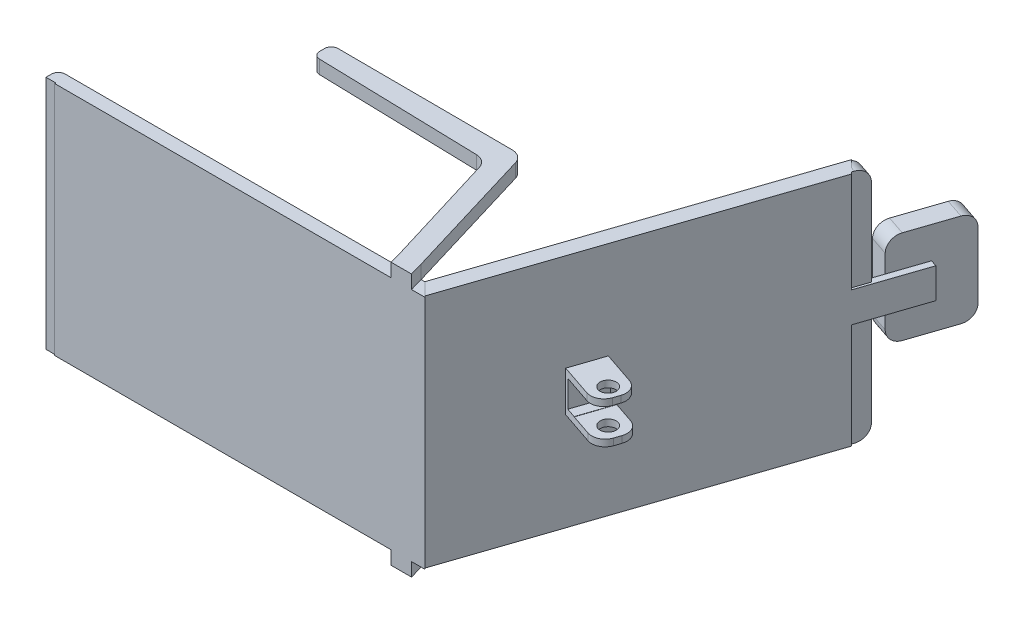
from build123d import *

# Parameters (mm, degrees)
SKETCH1_W            = 549.87
SKETCH1_H            = 349.87
BOSS_EXTRUDE1_DEPTH  = 20
CUT_EXTRUDE1_DEPTH   = 390
BOSS_EXTRUDE2_DEPTH  = 350
SKETCH8_W            = 98.709573015
SKETCH8_H            = 45
SKETCH8_W_2          = 36.900765122
BOSS_EXTRUDE3_DEPTH  = 10
BOSS_EXTRUDE4_DEPTH  = 30
BOSS_EXTRUDE5_DEPTH  = 20
BOSS_EXTRUDE6_DEPTH  = 350
BOSS_EXTRUDE8_DEPTH  = 20
BOSS_EXTRUDE9_DEPTH  = 20
BOSS_EXTRUDE10_DEPTH = 20
SKETCH17_W           = 50
SKETCH17_H           = 60
BOSS_EXTRUDE11_DEPTH = 20
BOSS_EXTRUDE12_DEPTH = 10
BOSS_EXTRUDE13_DEPTH = 10
SKETCH29_W           = 50
SKETCH29_H           = 39.660478964
CUT_EXTRUDE2_DEPTH   = 15
CUT_EXTRUDE4_DEPTH   = 135
BOSS_EXTRUDE14_DEPTH = 15


with BuildPart() as part:
    # Sketch1 → Boss-Extrude1 (new body)
    with BuildSketch(Plane.XY):
        with Locations((274.935, 174.935)):
            Rectangle(SKETCH1_W, SKETCH1_H)
    extrude(amount=BOSS_EXTRUDE1_DEPTH)

    # Sketch5 → Cut-Extrude1 (cut)
    with BuildSketch(Plane.XZ):
        Polygon((549.87, 20), (549.87, 0), (529.87, 0), align=None)
    extrude(amount=-CUT_EXTRUDE1_DEPTH, mode=Mode.SUBTRACT)

    # Sketch7 → Boss-Extrude2 (add)
    with BuildSketch(Plane(origin=(0, 0, 0), x_dir=(1, 0, 0), z_dir=(0, 1, 0))):
        Polygon((548.247682742, -18.377682742), (529.87, 0), (689.729206908, 473.756302298), (708.188601763, 455.296907443), align=None)
    extrude(amount=BOSS_EXTRUDE2_DEPTH)

    # Sketch8 → Boss-Extrude3 (add)
    with BuildSketch(Plane(origin=(497.707374269, 0, 168.055826709), x_dir=(0.3199146533951787, 0, -0.9474463649954242), z_dir=(0.9474463649954242, 0, 0.3199146533951787))):
        with Locations((707.28409753, 178.525129773)):
            Rectangle(SKETCH8_W, SKETCH8_H)
        with Locations((639.478928461, 178.525129773)):
            Rectangle(SKETCH8_W_2, SKETCH8_H)
    extrude(amount=-BOSS_EXTRUDE3_DEPTH)

    # Sketch9 → Boss-Extrude4 (add)
    with BuildSketch(Plane(origin=(488.232910619, 0, 164.856680175), x_dir=(-0.3199146533951788, 0, 0.9474463649954242), z_dir=(-0.9474463649954242, 0, -0.3199146533951788))):
        with BuildLine():
            Line((-791.020826049, 109.23003489), (-722.256942025, 109.23003489))
            ThreePointArc((-722.256942025, 109.23003489), (-708.114806401, 115.087899266), (-702.256942025, 129.23003489))
            Line((-702.256942025, 129.23003489), (-702.256942025, 227.820224656))
            ThreePointArc((-702.256942025, 227.820224656), (-708.114806401, 241.96236028), (-722.256942025, 247.820224656))
            Line((-722.256942025, 247.820224656), (-791.020826049, 247.820224656))
            ThreePointArc((-791.020826049, 247.820224656), (-805.162961673, 241.96236028), (-811.020826049, 227.820224656))
            Line((-811.020826049, 227.820224656), (-811.020826049, 129.23003489))
            ThreePointArc((-811.020826049, 129.23003489), (-805.162961673, 115.087899266), (-791.020826049, 109.23003489))
        make_face()
    extrude(amount=BOSS_EXTRUDE4_DEPTH)

    # Sketch10 → Boss-Extrude5 (add)
    with BuildSketch(Plane(origin=(475.706760592, 0, 160.517348477), x_dir=(-0.31971841381659616, 0, 0.947512604595105), z_dir=(-0.947512604595105, 0, -0.31971841381659616))):
        with BuildLine():
            Line((-169.409195929, 0), (-662.734204759, 0))
            ThreePointArc((-662.734204759, 0), (-676.876340383, 5.857864376), (-682.734204759, 20))
            Line((-682.734204759, 20), (-682.734204759, 330))
            ThreePointArc((-682.734204759, 330), (-676.876340383, 344.142135624), (-662.734204759, 350))
            Line((-662.734204759, 350), (-169.409195929, 350))
            Line((-169.409195929, 350), (-169.409195929, 0))
        make_face()
    extrude(amount=-BOSS_EXTRUDE5_DEPTH)

    # Sketch12 → Boss-Extrude6 (add)
    with BuildSketch(Plane(origin=(0, 349.87, 0), x_dir=(1, 0, 0), z_dir=(0, 1, 0))):
        with BuildLine():
            Line((548.247682742, -18.377682742), (-14.595850042, -18.377682742))
            Line((-14.595850042, -18.377682742), (-14.595850042, -10))
            ThreePointArc((-14.595850042, -10), (-11.666917854, -2.928932188), (-4.595850042, 0))
            Line((-4.595850042, 0), (548.247682742, 0))
            Line((548.247682742, 0), (548.247682742, -18.377682742))
        make_face()
    extrude(amount=-BOSS_EXTRUDE6_DEPTH)

    # Sketch13 → Boss-Extrude8 (add)
    with BuildSketch(Plane(origin=(0, 0, 0), x_dir=(1, 0, 0), z_dir=(0, 1, 0))):
        with BuildLine():
            Line((529.87, -20), (466.920463419, 203.866030957))
            ThreePointArc((466.920463419, 203.866030957), (459.744453874, 214.393873705), (447.66715807, 218.452138352))
            Line((447.66715807, 218.452138352), (182.353481149, 218.452138352))
            ThreePointArc((182.353481149, 218.452138352), (175.282413337, 215.523206164), (172.353481149, 208.452138352))
            Line((172.353481149, 208.452138352), (172.353481149, 195.44469829))
            ThreePointArc((172.353481149, 195.44469829), (175.282413337, 188.373630478), (182.353481149, 185.44469829))
            Line((182.353481149, 185.44469829), (426.76244603, 185.44469829))
            ThreePointArc((426.76244603, 185.44469829), (438.839741835, 181.386433642), (446.015751379, 170.858590894))
            Line((446.015751379, 170.858590894), (499.683830444, -20))
            Line((499.683830444, -20), (529.87, -20))
        make_face()
    extrude(amount=-BOSS_EXTRUDE8_DEPTH)



with BuildPart() as body_2:
    # Sketch14 → Boss-Extrude9 (new body)
    with BuildSketch(Plane(origin=(0, 349.87, 0), x_dir=(1, 0, 0), z_dir=(0, 1, 0))):
        with BuildLine():
            Line((443.036766756, 167.600120696), (494.059972611, 0))
            Line((494.059972611, 0), (524.246142168, 0))
            Line((524.246142168, 0), (464.010310028, 200.21481189))
            ThreePointArc((464.010310028, 200.21481189), (456.822450051, 210.479641737), (444.937703146, 214.45265745))
            Line((444.937703146, 214.45265745), (185.322113663, 215.483347913))
            ThreePointArc((185.322113663, 215.483347913), (178.225395669, 212.568516812), (175.282413337, 205.483426719))
            Line((175.282413337, 205.483426719), (175.282413337, 198.112032973))
            ThreePointArc((175.282413337, 198.112032973), (178.118260224, 191.135292318), (185.017395372, 188.115545316))
            Line((185.017395372, 188.115545316), (424.433785373, 181.768351511))
            ThreePointArc((424.433785373, 181.768351511), (436.021653833, 177.686265336), (443.036766756, 167.600120696))
        make_face()
    extrude(amount=BOSS_EXTRUDE9_DEPTH)


with BuildPart() as part_1:
    add(part.part)

    add(body_2.part)  # Boss-Extrude10 merges body 2
    # Sketch15 → Boss-Extrude10 (add)
    with BuildSketch(Plane(origin=(0, 349.87, 0), x_dir=(1, 0, 0), z_dir=(0, 1, 0))):
        Polygon((494.059972611, 0), (499.683830444, -20), (529.87, -20), (524.246142168, 0), align=None)
    extrude(amount=BOSS_EXTRUDE10_DEPTH)

    # Sketch17 → Boss-Extrude11 (add)
    with BuildSketch(Plane(origin=(497.707374269, 0, 168.055826709), x_dir=(0.3199146533951787, 0, -0.9474463649954242), z_dir=(0.9474463649954242, 0, 0.3199146533951787))):
        with Locations((347.90462616, 175.421978984)):
            Rectangle(SKETCH17_W, SKETCH17_H)
    extrude(amount=BOSS_EXTRUDE11_DEPTH)

    # Sketch27 → Boss-Extrude12 (add)
    with BuildSketch(Plane(origin=(0, 145.421978984, 0), x_dir=(-1, 0, 0), z_dir=(0, -1, 0))):
        with BuildLine():
            Line((-619.958223127, 131.480694519), (-651.009295827, 120.995992137))
            ThreePointArc((-651.009295827, 120.995992137), (-666.282227468, 122.02172803), (-676.356516195, 133.546626369))
            Line((-676.356516195, 133.546626369), (-679.555662729, 143.021090019))
            ThreePointArc((-679.555662729, 143.021090019), (-678.529926835, 158.29402166), (-667.005028497, 168.368310386))
            Line((-667.005028497, 168.368310386), (-635.953955796, 178.853012769))
            Line((-635.953955796, 178.853012769), (-619.958223127, 131.480694519))
        make_face()
    extrude(amount=-BOSS_EXTRUDE12_DEPTH)

    # Sketch28 → Boss-Extrude13 (add)
    with BuildSketch(Plane(origin=(0, 205.421978984, 0), x_dir=(1, 0, 0), z_dir=(0, 1, 0))):
        with BuildLine():
            Line((635.953955796, 178.853012769), (664.377346746, 169.255573167))
            ThreePointArc((664.377346746, 169.255573167), (675.902245085, 159.181284441), (676.927980978, 143.908352799))
            Line((676.927980978, 143.908352799), (673.728834444, 134.433889149))
            ThreePointArc((673.728834444, 134.433889149), (663.654545718, 122.908990811), (648.381614077, 121.883254917))
            Line((648.381614077, 121.883254917), (619.958223127, 131.480694519))
            Line((619.958223127, 131.480694519), (635.953955796, 178.853012769))
        make_face()
    extrude(amount=-BOSS_EXTRUDE13_DEPTH)

    # Sketch29 → Cut-Extrude2 (cut)
    with BuildSketch(Plane(origin=(516.656301569, 0, 174.454119777), x_dir=(0.3199146533951788, 0, -0.9474463649954242), z_dir=(0.9474463649954242, 0, 0.3199146533951788))):
        with Locations((347.90462616, 175.591739502)):
            Rectangle(SKETCH29_W, SKETCH29_H)
    extrude(amount=-CUT_EXTRUDE2_DEPTH, mode=Mode.SUBTRACT)

    # Sketch30 → Cut-Extrude4 (cut)
    with BuildSketch(Plane(origin=(0, 205.421978984, 0), x_dir=(1, 0, 0), z_dir=(0, 1, 0))):
        with BuildLine():
            ThreePointArc((652.540504571, 134.200057662), (661.704263556, 134.815499198), (667.748836791, 141.730438201))
            Line((667.748836791, 141.730438201), (656.379480411, 145.569414042))
            Line((656.379480411, 145.569414042), (652.540504571, 134.200057662))
        make_face()
        with BuildLine():
            Line((656.379480411, 145.569414042), (667.748836791, 141.730438201))
            ThreePointArc((667.748836791, 141.730438201), (668.220769964, 143.624198959), (668.379480411, 145.569414042))
            ThreePointArc((668.379480411, 145.569414042), (666.128011329, 152.566995407), (660.218456252, 156.938770422))
            Line((660.218456252, 156.938770422), (656.379480411, 145.569414042))
        make_face()
        with BuildLine():
            Line((652.540504571, 134.200057662), (656.379480411, 145.569414042))
            Line((656.379480411, 145.569414042), (645.010124031, 149.408389883))
            ThreePointArc((645.010124031, 149.408389883), (645.625565568, 140.244630898), (652.540504571, 134.200057662))
        make_face()
        with BuildLine():
            Line((645.010124031, 149.408389883), (656.379480411, 145.569414042))
            Line((656.379480411, 145.569414042), (660.218456252, 156.938770422))
            ThreePointArc((660.218456252, 156.938770422), (651.054697267, 156.323328886), (645.010124031, 149.408389883))
        make_face()
        with BuildLine():
            ThreePointArc((652.540504571, 134.200057662), (661.704263556, 134.815499198), (667.748836791, 141.730438201))
            Line((667.748836791, 141.730438201), (656.379480411, 145.569414042))
            Line((656.379480411, 145.569414042), (652.540504571, 134.200057662))
        make_face()
        with BuildLine():
            Line((656.379480411, 145.569414042), (667.748836791, 141.730438201))
            ThreePointArc((667.748836791, 141.730438201), (668.220769964, 143.624198959), (668.379480411, 145.569414042))
            ThreePointArc((668.379480411, 145.569414042), (666.128011329, 152.566995407), (660.218456252, 156.938770422))
            Line((660.218456252, 156.938770422), (656.379480411, 145.569414042))
        make_face()
        with BuildLine():
            Line((652.540504571, 134.200057662), (656.379480411, 145.569414042))
            Line((656.379480411, 145.569414042), (645.010124031, 149.408389883))
            ThreePointArc((645.010124031, 149.408389883), (645.625565568, 140.244630898), (652.540504571, 134.200057662))
        make_face()
        with BuildLine():
            Line((645.010124031, 149.408389883), (656.379480411, 145.569414042))
            Line((656.379480411, 145.569414042), (660.218456252, 156.938770422))
            ThreePointArc((660.218456252, 156.938770422), (651.054697267, 156.323328886), (645.010124031, 149.408389883))
        make_face()
        with BuildLine():
            ThreePointArc((652.540504571, 134.200057662), (661.704263556, 134.815499198), (667.748836791, 141.730438201))
            Line((667.748836791, 141.730438201), (656.379480411, 145.569414042))
            Line((656.379480411, 145.569414042), (652.540504571, 134.200057662))
        make_face()
        with BuildLine():
            Line((656.379480411, 145.569414042), (667.748836791, 141.730438201))
            ThreePointArc((667.748836791, 141.730438201), (668.220769964, 143.624198959), (668.379480411, 145.569414042))
            ThreePointArc((668.379480411, 145.569414042), (666.128011329, 152.566995407), (660.218456252, 156.938770422))
            Line((660.218456252, 156.938770422), (656.379480411, 145.569414042))
        make_face()
        with BuildLine():
            Line((652.540504571, 134.200057662), (656.379480411, 145.569414042))
            Line((656.379480411, 145.569414042), (645.010124031, 149.408389883))
            ThreePointArc((645.010124031, 149.408389883), (645.625565568, 140.244630898), (652.540504571, 134.200057662))
        make_face()
        with BuildLine():
            Line((645.010124031, 149.408389883), (656.379480411, 145.569414042))
            Line((656.379480411, 145.569414042), (660.218456252, 156.938770422))
            ThreePointArc((660.218456252, 156.938770422), (651.054697267, 156.323328886), (645.010124031, 149.408389883))
        make_face()
        with BuildLine():
            ThreePointArc((652.540504571, 134.200057662), (661.704263556, 134.815499198), (667.748836791, 141.730438201))
            Line((667.748836791, 141.730438201), (656.379480411, 145.569414042))
            Line((656.379480411, 145.569414042), (652.540504571, 134.200057662))
        make_face()
        with BuildLine():
            Line((656.379480411, 145.569414042), (667.748836791, 141.730438201))
            ThreePointArc((667.748836791, 141.730438201), (668.220769964, 143.624198959), (668.379480411, 145.569414042))
            ThreePointArc((668.379480411, 145.569414042), (666.128011329, 152.566995407), (660.218456252, 156.938770422))
            Line((660.218456252, 156.938770422), (656.379480411, 145.569414042))
        make_face()
        with BuildLine():
            Line((652.540504571, 134.200057662), (656.379480411, 145.569414042))
            Line((656.379480411, 145.569414042), (645.010124031, 149.408389883))
            ThreePointArc((645.010124031, 149.408389883), (645.625565568, 140.244630898), (652.540504571, 134.200057662))
        make_face()
        with BuildLine():
            Line((645.010124031, 149.408389883), (656.379480411, 145.569414042))
            Line((656.379480411, 145.569414042), (660.218456252, 156.938770422))
            ThreePointArc((660.218456252, 156.938770422), (651.054697267, 156.323328886), (645.010124031, 149.408389883))
        make_face()
    extrude(amount=-CUT_EXTRUDE4_DEPTH, mode=Mode.SUBTRACT)

    # Sketch42 → Boss-Extrude14 (add)
    # profile 1 of 11: a face of its own
    with BuildSketch(Plane(origin=(475.706760592, 0, 160.517348477), x_dir=(-0.31971841381659616, 0, 0.947512604595105), z_dir=(-0.947512604595105, 0, -0.31971841381659616))):
        with BuildLine():
            add(Edge.make_bspline(
                [(-638.513116522, 190.122907371), (-638.360571169, 190.211273718), (-638.060923429, 190.384853414), (-637.579496181, 190.565813864), (-637.086263271, 190.676962054), (-636.752581471, 190.690491691), (-636.585469516, 190.6972675)],
                knots=[0, 0, 0, 0, 1.036768787, 2.036544669, 3.016677383, 4, 4, 4, 4], degree=3))
            add(Edge.make_bspline(
                [(-636.585469516, 190.6972675), (-636.436766823, 190.691779815), (-636.15720494, 190.681462939), (-635.765197281, 190.590814265), (-635.430097081, 190.437363554), (-635.154393556, 190.216239024), (-634.944873454, 189.92874706), (-634.793961431, 189.583016219), (-634.710947825, 189.174708565), (-634.699360103, 188.884074511), (-634.693228271, 188.730280759)],
                knots=[0, 0, 0, 0, 1.139984686, 2.143177509, 3.066031338, 3.946141936, 4.823659816, 5.769812123, 6.819859698, 8, 8, 8, 8], degree=3))
            add(Edge.make_bspline(
                [(-634.693228271, 188.730280759), (-634.695108663, 188.541395579), (-634.698730332, 188.177599477), (-634.736866979, 187.654436217), (-634.805777842, 187.178370881), (-634.886530881, 186.746015215), (-635.007327851, 186.362713941), (-635.145599567, 186.021285422), (-635.315562197, 185.727764071), (-635.510203371, 185.47813197), (-635.732840725, 185.274670334), (-635.963075265, 185.089221655), (-636.218905319, 184.942405739), (-636.486391317, 184.81211411), (-636.776317785, 184.721585748), (-637.080527645, 184.647255948), (-637.40417421, 184.61058435), (-637.625284471, 184.603317233), (-637.738123746, 184.599608602)],
                knots=[0, 0, 0, 0, 1.541598652, 2.9691455, 4.276955055, 5.467132355, 6.553865397, 7.551736534, 8.467784926, 9.313610522, 10.123739213, 10.924480563, 11.721134092, 12.525515356, 13.347993854, 14.194361039, 15.078527651, 16, 16, 16, 16], degree=3))
            add(Edge.make_bspline(
                [(-637.738123746, 184.599608602), (-637.864242904, 184.603145147), (-638.107480019, 184.609965832), (-638.454445345, 184.66838913), (-638.767369575, 184.767326614), (-639.044179326, 184.904411904), (-639.287872284, 185.081462222), (-639.491775796, 185.300462834), (-639.667066892, 185.556529656), (-639.746632831, 185.750459091), (-639.78772393, 185.85061217)],
                knots=[0, 0, 0, 0, 1.1739016, 2.264021137, 3.264253968, 4.219962044, 5.128556851, 6.052854016, 6.994414316, 8, 8, 8, 8], degree=3))
            add(Edge.make_bspline(
                [(-639.78772393, 185.85061217), (-639.82096966, 185.939394863), (-639.881618001, 186.101356206), (-639.994350787, 186.310792837), (-640.119405915, 186.463622644), (-640.27519603, 186.565244993), (-640.490339741, 186.618250838), (-640.788791485, 186.645730151), (-641.19181678, 186.670422027), (-641.495025236, 186.671956386), (-641.664229281, 186.672812627)],
                knots=[0, 0, 0, 0, 0.998224434, 1.821005481, 2.497006745, 3.056633002, 3.747582273, 4.805163592, 6.217136645, 8, 8, 8, 8], degree=3))
            add(Edge.make_bspline(
                [(-641.664229281, 186.672812627), (-641.775756118, 186.668929233), (-642.002058531, 186.661049324), (-642.348979205, 186.62304754), (-642.704817349, 186.543532237), (-643.076899937, 186.448332573), (-643.457765918, 186.313179339), (-643.856723583, 186.16493738), (-644.259604744, 185.970473945), (-644.680368777, 185.759615789), (-645.109352953, 185.513344029), (-645.557583611, 185.249338941), (-646.006699962, 184.940776045), (-646.477783505, 184.617466238), (-646.954345555, 184.257141675), (-647.450657218, 183.875560528), (-647.953276564, 183.459406548), (-648.464100656, 183.023423766), (-648.963907423, 182.578972062), (-649.4381597, 182.133603594), (-649.876450386, 181.693004161), (-650.288639117, 181.264176049), (-650.665761645, 180.840697284), (-651.008183186, 180.422308509), (-651.320762015, 180.014869533), (-651.595266575, 179.610666206), (-651.846420251, 179.218999453), (-652.057714119, 178.83043711), (-652.236090886, 178.448812894), (-652.387049817, 178.077109907), (-652.502812673, 177.710196707), (-652.579598972, 177.348913997), (-652.635522955, 176.996966484), (-652.641181204, 176.763340259), (-652.64394927, 176.649048195)],
                knots=[0, 0, 0, 0, 0.682775279, 1.38543957, 2.131348223, 2.911801729, 3.733915265, 4.602634371, 5.514418629, 6.468943887, 7.482101838, 8.54029698, 9.650770625, 10.81490889, 12.036131024, 13.305662984, 14.645344397, 16.02825241, 17.414903013, 18.737462885, 20.008363339, 21.217186419, 22.376614359, 23.476924672, 24.524848798, 25.517464163, 26.465797839, 27.370635879, 28.221344803, 29.042322037, 29.823970757, 30.571560601, 31.301194512, 32, 32, 32, 32], degree=3))
            add(Edge.make_bspline(
                [(-652.64394927, 176.649048195), (-652.641059151, 176.551803279), (-652.635360851, 176.360070501), (-652.585889911, 176.077668109), (-652.507987096, 175.805390757), (-652.395730989, 175.543214182), (-652.254018387, 175.290792069), (-652.079506529, 175.049541583), (-651.872128669, 174.820657491), (-651.638787137, 174.602385427), (-651.380376392, 174.401898175), (-651.099560493, 174.227726021), (-650.797980309, 174.082982861), (-650.480658577, 173.959273571), (-650.142196499, 173.870394454), (-649.787243071, 173.804202632), (-649.414044692, 173.758014572), (-649.158591803, 173.755117583), (-649.02862764, 173.753643712)],
                knots=[0, 0, 0, 0, 0.904593665, 1.783540604, 2.660450977, 3.535575467, 4.43189574, 5.349977517, 6.300825444, 7.302644566, 8.320765294, 9.34034842, 10.372133858, 11.430790051, 12.505648256, 13.623652302, 14.791009797, 16, 16, 16, 16], degree=3))
            add(Edge.make_bspline(
                [(-649.02862764, 173.753643712), (-648.79239674, 173.757971317), (-648.326718105, 173.766502266), (-647.643314552, 173.839945565), (-646.985448731, 173.952473479), (-646.448835514, 174.090097845), (-646.00775688, 174.23241746), (-645.637067888, 174.367872761), (-645.223954186, 174.529344181), (-644.769723885, 174.718940571), (-644.271127482, 174.930478522), (-643.734449039, 175.176967116), (-643.150897888, 175.442938593), (-642.749740117, 175.633509819), (-642.541505368, 175.732432373)],
                knots=[0, 0, 0, 0, 1.241141538, 2.446644768, 3.607943349, 4.746193739, 5.354240492, 6.043105108, 6.819910247, 7.685049011, 8.629749558, 9.66605256, 10.788484248, 12, 12, 12, 12], degree=3))
            add(Edge.make_bspline(
                [(-642.541505368, 175.732432373), (-642.422410091, 175.786724244), (-642.193169366, 175.891228033), (-641.860458372, 176.032775398), (-641.553684243, 176.15164853), (-641.272563398, 176.246708725), (-641.016738164, 176.322000431), (-640.786124022, 176.378410703), (-640.579410143, 176.411842892), (-640.450038794, 176.418001594), (-640.389621873, 176.420877733)],
                knots=[0, 0, 0, 0, 1.382158959, 2.660450771, 3.817726487, 4.855582095, 5.793363786, 6.633078067, 7.361642167, 8, 8, 8, 8], degree=3))
            add(Edge.make_bspline(
                [(-640.389621873, 176.420877733), (-640.24092875, 176.416597804), (-639.956476819, 176.408410243), (-639.551681817, 176.318429779), (-639.188765679, 176.177842997), (-638.873352998, 175.981924875), (-638.616231538, 175.742638927), (-638.422451906, 175.468886456), (-638.307479827, 175.157492599), (-638.295142926, 174.938693154), (-638.288880034, 174.827618472)],
                knots=[0, 0, 0, 0, 1.212489222, 2.319508074, 3.367559267, 4.377888122, 5.332533411, 6.217798757, 7.095256229, 8, 8, 8, 8], degree=3))
            add(Edge.make_bspline(
                [(-638.288880034, 174.827618472), (-638.296831657, 174.719164332), (-638.312793534, 174.501456401), (-638.432963692, 174.184740692), (-638.639730825, 173.894581169), (-638.866459951, 173.66620479), (-639.09708043, 173.48356995), (-639.319072418, 173.329810889), (-639.58845959, 173.165742708), (-639.902735996, 172.986134778), (-640.259899077, 172.789020258), (-640.663515745, 172.581025391), (-641.111086096, 172.356111403), (-641.767747166, 172.045532136), (-642.612036352, 171.66059045), (-643.647296572, 171.2674835), (-644.676273901, 170.91588883), (-645.707253598, 170.635984927), (-646.731511379, 170.406400566), (-647.750613506, 170.253662529), (-648.761495035, 170.147317588), (-649.43355632, 170.136059961), (-649.768214655, 170.130454134)],
                knots=[0, 0, 0, 0, 0.501733835, 1.007167039, 1.544578627, 2.141565691, 2.49158203, 2.906065294, 3.39150616, 3.952001113, 4.582643857, 5.280803269, 6.054932984, 6.902557995, 8.645331104, 10.35078883, 12.029463162, 13.679768984, 15.296436613, 16.888176814, 18.45044256, 20, 20, 20, 20], degree=3))
            add(Edge.make_bspline(
                [(-649.768214655, 170.130454134), (-650.054305773, 170.135385455), (-650.612000977, 170.144998384), (-651.42712777, 170.230216588), (-652.200261698, 170.364493138), (-652.928779419, 170.562317885), (-653.614941662, 170.811042839), (-654.259300427, 171.111734461), (-654.855507572, 171.478638335), (-655.407801211, 171.888643899), (-655.905764422, 172.336982447), (-656.33496668, 172.816363923), (-656.705801323, 173.308679984), (-657.006827326, 173.823388419), (-657.242868704, 174.358895452), (-657.405164012, 174.916022486), (-657.514657326, 175.490802006), (-657.524815654, 175.88141267), (-657.529944335, 176.07862204)],
                knots=[0, 0, 0, 0, 1.261916356, 2.459932018, 3.611852766, 4.72059656, 5.785811717, 6.828798049, 7.851807195, 8.868926038, 9.860177737, 10.80240016, 11.703807258, 12.575038667, 13.427432305, 14.278627365, 15.130922822, 16, 16, 16, 16], degree=3))
            add(Edge.make_bspline(
                [(-657.529944335, 176.07862204), (-657.525002481, 176.25846248), (-657.515049875, 176.62065063), (-657.445908656, 177.166849003), (-657.33086248, 177.717434066), (-657.1724082, 178.273254482), (-656.971838723, 178.833941062), (-656.720780287, 179.397215508), (-656.429147009, 179.969093315), (-656.092063095, 180.546953953), (-655.701803206, 181.123941285), (-655.278756069, 181.712820372), (-654.803372753, 182.302593173), (-654.28630246, 182.899536766), (-653.718654565, 183.498582944), (-653.112648738, 184.107498333), (-652.455820994, 184.716449061), (-651.768062736, 185.328949526), (-651.05713446, 185.921783327), (-650.345024288, 186.486570581), (-649.637010125, 187.008930705), (-648.936172897, 187.494669138), (-648.239750176, 187.940218547), (-647.546587776, 188.344154894), (-646.862216986, 188.716510947), (-646.180974172, 189.047409011), (-645.50477611, 189.338444075), (-644.834370223, 189.591673886), (-644.168828557, 189.805288898), (-643.507591349, 189.97650561), (-642.853554258, 190.118606308), (-642.203759204, 190.2093426), (-641.560587267, 190.273096958), (-641.133296672, 190.280511402), (-640.920708293, 190.284200284)],
                knots=[0, 0, 0, 0, 0.737863862, 1.486014752, 2.255305732, 3.043923975, 3.855769495, 4.696573199, 5.572505824, 6.488886677, 7.43950751, 8.429689702, 9.463290307, 10.546511523, 11.669430986, 12.84889927, 14.070936537, 15.343994743, 16.627471688, 17.86865578, 19.072889413, 20.237076581, 21.367000021, 22.46425592, 23.528385667, 24.563176048, 25.570677144, 26.548072383, 27.502704933, 28.437153151, 29.349988629, 30.247148378, 31.127909929, 32, 32, 32, 32], degree=3))
            add(Edge.make_bspline(
                [(-640.920708293, 190.284200284), (-640.676775379, 190.281451876), (-640.217593995, 190.276278249), (-639.571827086, 190.251262797), (-639.01198848, 190.203663308), (-638.670234859, 190.148341229), (-638.513116522, 190.122907371)],
                knots=[0, 0, 0, 0, 1.211667241, 2.280852676, 3.209636558, 4, 4, 4, 4], degree=3))
        make_face()
    # profile 2 of 11: a face of its own
    with BuildSketch(Plane(origin=(475.706760592, 0, 160.517348477), x_dir=(-0.31971841381659616, 0, 0.947512604595105), z_dir=(-0.947512604595105, 0, -0.31971841381659616))):
        with BuildLine():
            add(Edge.make_bspline(
                [(-617.117808341, 176.739529585), (-617.111228683, 176.976018464), (-617.09785421, 177.456729447), (-616.978323694, 178.183831477), (-616.803496589, 178.93092698), (-616.546956695, 179.694929214), (-616.223884586, 180.480314706), (-615.823342603, 181.280642496), (-615.357860365, 182.102625418), (-614.821777188, 182.931509568), (-614.231633892, 183.757961734), (-613.577639017, 184.547421798), (-612.873627786, 185.296273356), (-612.125959495, 186.012355804), (-611.321471281, 186.682587328), (-610.471430977, 187.319045375), (-609.566083758, 187.908264946), (-608.620197556, 188.459681009), (-607.643350699, 188.964012696), (-606.641030988, 189.394282066), (-605.630269816, 189.768310654), (-604.602536693, 190.065327808), (-603.564392204, 190.305073815), (-602.51089414, 190.466158312), (-601.445860144, 190.575482525), (-600.730462836, 190.585842826), (-600.370883227, 190.591050216)],
                knots=[0, 0, 0, 0, 0.718305306, 1.460099313, 2.234436018, 3.048632044, 3.906463747, 4.813721131, 5.766839485, 6.776213419, 7.812662612, 8.851652876, 9.889319804, 10.935197836, 11.996125464, 13.069852491, 14.160926274, 15.277216218, 16.396625338, 17.499824989, 18.590491041, 19.670112219, 20.749144695, 21.826387015, 22.907478546, 24, 24, 24, 24], degree=3))
            add(Edge.make_bspline(
                [(-600.370883227, 190.591050216), (-599.947176727, 190.587614291), (-599.12651191, 190.580959349), (-597.937346842, 190.498871643), (-596.829879384, 190.377012029), (-595.804685288, 190.201460536), (-594.860382425, 189.974492869), (-593.996404904, 189.697228459), (-593.212716899, 189.368129132), (-592.512970528, 188.985562669), (-591.890373607, 188.557158015), (-591.357277033, 188.068133826), (-590.895795891, 187.53551626), (-590.530601157, 186.94168038), (-590.23832046, 186.303024065), (-590.036863, 185.611214062), (-589.905451967, 184.870804093), (-589.893157265, 184.358916112), (-589.886843897, 184.096059996)],
                knots=[0, 0, 0, 0, 1.460243717, 2.828303659, 4.106660742, 5.299358798, 6.411018212, 7.451642688, 8.42383173, 9.336152914, 10.196362235, 11.021871344, 11.823472311, 12.617390024, 13.416438115, 14.23730594, 15.094850963, 16, 16, 16, 16], degree=3))
            add(Edge.make_bspline(
                [(-589.886843897, 184.096059996), (-589.89095672, 183.878276446), (-589.899145744, 183.444648586), (-589.954961673, 182.796812976), (-590.050659901, 182.154919353), (-590.179703784, 181.516124102), (-590.34870706, 180.882715225), (-590.559256147, 180.255908298), (-590.803509693, 179.633563993), (-591.083158016, 179.014486699), (-591.401234623, 178.400546715), (-591.76318059, 177.794275178), (-592.154020418, 177.18765564), (-592.588342989, 176.590664088), (-593.059158953, 175.998248374), (-593.565028466, 175.409690032), (-594.110073605, 174.82608566), (-594.688087098, 174.25192659), (-595.291271184, 173.697197402), (-595.916540092, 173.176988695), (-596.551399478, 172.687049043), (-597.207471539, 172.240724712), (-597.870997755, 171.820623733), (-598.552737927, 171.442444346), (-599.25178145, 171.104976213), (-599.963661184, 170.796989281), (-600.69058565, 170.524850412), (-601.433731177, 170.294344875), (-602.188584228, 170.090945435), (-602.961360189, 169.931238475), (-603.747693624, 169.805646966), (-604.548254642, 169.713857386), (-605.363762296, 169.663789706), (-605.912478125, 169.654961825), (-606.189230008, 169.65050937)],
                knots=[0, 0, 0, 0, 0.871986245, 1.736207939, 2.601274557, 3.469331632, 4.344300438, 5.224296037, 6.115467322, 7.020178027, 7.943095327, 8.882297872, 9.846399138, 10.831545224, 11.836870922, 12.875643769, 13.938124292, 15.033376516, 16.137103645, 17.218104638, 18.289267898, 19.346598421, 20.394039972, 21.432865896, 22.466103833, 23.500941416, 24.537655431, 25.572226579, 26.615289924, 27.666672004, 28.730138059, 29.802818712, 30.891823371, 32, 32, 32, 32], degree=3))
            add(Edge.make_bspline(
                [(-606.189230008, 169.65050937), (-606.580227449, 169.656109946), (-607.34504683, 169.66706508), (-608.465214224, 169.765649947), (-609.53342779, 169.913657095), (-610.546062529, 170.136409958), (-611.505996186, 170.413112387), (-612.408980139, 170.757060514), (-613.261340916, 171.157848769), (-614.049628032, 171.623969288), (-614.768316091, 172.132989312), (-615.395089985, 172.686705191), (-615.928490927, 173.273950203), (-616.360558451, 173.900611344), (-616.700623915, 174.559725044), (-616.940868411, 175.255022069), (-617.092949333, 175.985485583), (-617.109439933, 176.485692097), (-617.117808341, 176.739529585)],
                knots=[0, 0, 0, 0, 1.29899038, 2.540919483, 3.733956212, 4.880100262, 5.983234509, 7.050678372, 8.087616104, 9.109205433, 10.089875583, 11.009743166, 11.882943437, 12.719359784, 13.532011139, 14.339564659, 15.157386552, 16, 16, 16, 16], degree=3))
        make_face()
        with BuildLine():
            add(Edge.make_bspline(
                [(-612.161001754, 177.392569183), (-612.154404481, 177.245324863), (-612.141388964, 176.954831981), (-612.054179782, 176.52814889), (-611.901023534, 176.124632372), (-611.69559275, 175.737198253), (-611.423448189, 175.374341746), (-611.095427702, 175.031560312), (-610.707200761, 174.710761551), (-610.266717277, 174.410539406), (-609.777399103, 174.143586424), (-609.254696255, 173.905372741), (-608.698663562, 173.703669186), (-608.107812808, 173.546600743), (-607.488777063, 173.413855094), (-606.836617392, 173.324563844), (-606.151990362, 173.27475281), (-605.684450908, 173.266242623), (-605.445709019, 173.261897026)],
                knots=[0, 0, 0, 0, 0.811095459, 1.600180282, 2.386449716, 3.181463629, 4.007854504, 4.876420815, 5.789274826, 6.777023483, 7.808394398, 8.855779866, 9.938874345, 11.0621491, 12.221023231, 13.424427817, 14.684823361, 16, 16, 16, 16], degree=3))
            add(Edge.make_bspline(
                [(-605.445709019, 173.261897026), (-605.098819361, 173.270658734), (-604.4129732, 173.287981774), (-603.402231037, 173.458748961), (-602.422320295, 173.718969329), (-601.475054088, 174.094495392), (-600.558947086, 174.571313782), (-599.679166028, 175.159985458), (-598.827814821, 175.847875914), (-598.029502011, 176.634412777), (-597.293436306, 177.471579828), (-596.639407311, 178.326648045), (-596.085298868, 179.188535064), (-595.634314726, 180.057977097), (-595.278201667, 180.931199385), (-595.031334845, 181.812956097), (-594.873900199, 182.700431303), (-594.853721462, 183.29551293), (-594.843650485, 183.592511391)],
                knots=[0, 0, 0, 0, 1.025747675, 2.028037125, 3.024955601, 4.021602125, 5.037020495, 6.075665841, 7.14902302, 8.271432871, 9.387808777, 10.445712215, 11.454404605, 12.415974257, 13.340543738, 14.239813033, 15.121510736, 16, 16, 16, 16], degree=3))
            add(Edge.make_bspline(
                [(-594.843650485, 183.592511391), (-594.848637402, 183.739585619), (-594.8583028, 184.024637671), (-594.919630973, 184.436182417), (-595.029633863, 184.815460148), (-595.18978504, 185.15908968), (-595.385771218, 185.47539323), (-595.633515793, 185.752619858), (-595.925031489, 185.994379343), (-596.262078954, 186.206287241), (-596.654103598, 186.386670779), (-597.104427119, 186.543975277), (-597.619113312, 186.669282577), (-598.193602139, 186.781440226), (-598.83406042, 186.859349828), (-599.535744229, 186.923873913), (-600.302369432, 186.957456331), (-600.83375439, 186.961711045), (-601.110470242, 186.963926665)],
                knots=[0, 0, 0, 0, 0.8737835, 1.693524311, 2.465095294, 3.211070692, 3.939427324, 4.667908935, 5.409027698, 6.182798011, 7.026185831, 7.96738264, 9.012264116, 10.170400367, 11.443015614, 12.843069047, 14.356045223, 16, 16, 16, 16], degree=3))
            add(Edge.make_bspline(
                [(-601.110470242, 186.963926665), (-601.341425192, 186.959285893), (-601.803100384, 186.950009066), (-602.492367065, 186.878098741), (-603.175428224, 186.754546087), (-603.85250343, 186.58570008), (-604.522544598, 186.368165036), (-605.18587473, 186.104781346), (-605.839904069, 185.787102629), (-606.484103604, 185.427364751), (-607.110352377, 185.031859254), (-607.709343436, 184.608134228), (-608.271884597, 184.153545241), (-608.806842787, 183.67611667), (-609.308191359, 183.169946918), (-609.77903586, 182.638110607), (-610.211835638, 182.07590539), (-610.611951604, 181.497879846), (-610.970225863, 180.915838422), (-611.286093706, 180.349232117), (-611.555783275, 179.804130679), (-611.770502101, 179.278246096), (-611.950800631, 178.77930271), (-612.064525594, 178.296944891), (-612.147723585, 177.838654206), (-612.156658831, 177.538471288), (-612.161001754, 177.392569183)],
                knots=[0, 0, 0, 0, 1.049274737, 2.097483147, 3.144691948, 4.201064833, 5.265672973, 6.343339803, 7.441289876, 8.566909144, 9.694293251, 10.80529357, 11.898674973, 12.978859009, 14.061652764, 15.133919875, 16.204165432, 17.283428819, 18.326816762, 19.308332447, 20.230334207, 21.087878014, 21.888713506, 22.637284277, 23.3376602, 24, 24, 24, 24], degree=3))
        make_face(mode=Mode.SUBTRACT)
    # profile 3 of 11: a face of its own
    with BuildSketch(Plane(origin=(475.706760592, 0, 160.517348477), x_dir=(-0.31971841381659616, 0, 0.947512604595105), z_dir=(-0.947512604595105, 0, -0.31971841381659616))):
        with BuildLine():
            Line((-572.268150259, 172.109242796), (-571.0604204, 176.275320714))
            add(Edge.make_bspline(
                [(-571.0604204, 176.275320714), (-570.929545543, 176.740549906), (-570.662314334, 177.690493707), (-570.274143434, 179.147496541), (-569.889138584, 180.665237364), (-569.502145672, 182.239256457), (-569.127500612, 183.876172087), (-568.744514202, 185.568220875), (-568.36598058, 187.321373755), (-568.123203162, 188.511047954), (-567.999789031, 189.11581016)],
                knots=[0, 0, 0, 0, 0.87846534, 1.793723863, 2.740672836, 3.724625809, 4.739941015, 5.792968499, 6.878071625, 8, 8, 8, 8], degree=3))
            add(Edge.make_bspline(
                [(-567.999789031, 189.11581016), (-567.968286183, 189.231976964), (-567.90356052, 189.470652956), (-567.700804304, 189.799869427), (-567.421184557, 190.106811571), (-567.071190848, 190.388461367), (-566.664102353, 190.629263093), (-566.214105441, 190.810347626), (-565.729201848, 190.91246023), (-565.395958944, 190.926274448), (-565.226337726, 190.933305909)],
                knots=[0, 0, 0, 0, 0.808197102, 1.660519508, 2.574811468, 3.599561369, 4.677854725, 5.753425158, 6.856489497, 8, 8, 8, 8], degree=3))
            add(Edge.make_bspline(
                [(-565.226337726, 190.933305909), (-565.080391199, 190.928265139), (-564.801909763, 190.918646817), (-564.404572565, 190.839213942), (-564.051089001, 190.70652641), (-563.745580221, 190.520855748), (-563.494670611, 190.294426976), (-563.311756064, 190.02812854), (-563.199358776, 189.727509733), (-563.18699568, 189.515417138), (-563.180671515, 189.406924198)],
                knots=[0, 0, 0, 0, 1.228136493, 2.343414556, 3.395456255, 4.391596827, 5.337186301, 6.219262611, 7.0890892, 8, 8, 8, 8], degree=3))
            add(Edge.make_bspline(
                [(-563.180671515, 189.406924198), (-563.183532188, 189.346487402), (-563.190851452, 189.191854933), (-563.242723052, 188.913559209), (-563.305758683, 188.533562919), (-563.409064682, 188.054944437), (-563.52897586, 187.472075285), (-563.678061028, 186.788417824), (-563.861421716, 186.006699436), (-563.989903186, 185.452002857), (-564.057947602, 185.158232837)],
                knots=[0, 0, 0, 0, 0.334195762, 0.855067112, 1.561868724, 2.464714081, 3.560957687, 4.852141462, 6.332878725, 8, 8, 8, 8], degree=3))
            Line((-564.057947602, 185.158232837), (-565.415168453, 179.501178969))
            add(Edge.make_bspline(
                [(-565.415168453, 179.501178969), (-565.459299214, 179.326654617), (-565.55536539, 178.946740774), (-565.721652176, 178.333273034), (-565.918697735, 177.630855894), (-566.143014182, 176.840144764), (-566.394875448, 175.961197982), (-566.677652264, 174.994595751), (-566.994077543, 173.939873475), (-567.213070793, 173.206844054), (-567.327079566, 172.82522597)],
                knots=[0, 0, 0, 0, 0.622097652, 1.35421508, 2.196439724, 3.143227442, 4.19459001, 5.356154097, 6.623603122, 8, 8, 8, 8], degree=3))
            add(Edge.make_bspline(
                [(-567.327079566, 172.82522597), (-566.974209906, 172.832813721), (-566.240188055, 172.848597383), (-565.100026322, 172.931827649), (-563.877412875, 173.058427954), (-562.572684076, 173.233965697), (-561.183376083, 173.44991772), (-559.711975974, 173.714986036), (-558.158151899, 174.026319899), (-557.097069643, 174.259398587), (-556.551926198, 174.379145495)],
                knots=[0, 0, 0, 0, 0.776673052, 1.615596511, 2.515005586, 3.481530348, 4.51257429, 5.60911546, 6.771655046, 8, 8, 8, 8], degree=3))
            add(Edge.make_bspline(
                [(-556.551926198, 174.379145495), (-556.415869835, 174.402068348), (-556.159219845, 174.445308884), (-555.899139085, 174.453823944), (-555.776933422, 174.457824965)],
                knots=[0, 0, 0, 0, 1.060248336, 2, 2, 2, 2], degree=3))
            add(Edge.make_bspline(
                [(-555.776933422, 174.457824965), (-555.613864623, 174.452184573), (-555.307167737, 174.441576224), (-554.881111915, 174.353928961), (-554.521325723, 174.201981182), (-554.244808759, 173.978891765), (-554.033798029, 173.732315392), (-553.879190441, 173.476155234), (-553.782515395, 173.212209106), (-553.769253354, 173.03184203), (-553.762738999, 172.943245174)],
                knots=[0, 0, 0, 0, 1.392722195, 2.61940705, 3.698263247, 4.696056319, 5.62607746, 6.46032653, 7.243707708, 8, 8, 8, 8], degree=3))
            add(Edge.make_bspline(
                [(-553.762738999, 172.943245174), (-553.766967979, 172.84568593), (-553.775313978, 172.65315035), (-553.851205566, 172.374970991), (-553.962132357, 172.110216092), (-554.136381002, 171.873003085), (-554.343021916, 171.645568505), (-554.605683213, 171.445494993), (-554.910629786, 171.260630804), (-555.268631749, 171.088618206), (-555.697470681, 170.930650115), (-556.209078485, 170.776073687), (-556.812341392, 170.618089462), (-557.510502161, 170.468975789), (-558.29914327, 170.309386179), (-559.181761802, 170.160413607), (-560.153881139, 169.999601702), (-561.197378527, 169.853557554), (-562.26409896, 169.707275429), (-563.310024372, 169.588568621), (-564.311519963, 169.47959138), (-565.268988595, 169.393811165), (-566.181741545, 169.325674701), (-567.050091648, 169.28008353), (-567.873604862, 169.244295137), (-568.408885907, 169.24232964), (-568.668564523, 169.241376127)],
                knots=[0, 0, 0, 0, 0.435104927, 0.858690326, 1.281179665, 1.710403452, 2.16654962, 2.650747116, 3.179433639, 3.758711163, 4.422690021, 5.219812876, 6.146616151, 7.208818076, 8.409890544, 9.742405425, 11.208823417, 12.813398261, 14.451192553, 16.020653284, 17.517623, 18.953401324, 20.316697456, 21.607938066, 22.839549175, 24, 24, 24, 24], degree=3))
            add(Edge.make_bspline(
                [(-568.668564523, 169.241376127), (-568.816822737, 169.242178154), (-569.103127187, 169.243726965), (-569.5186827, 169.275636747), (-569.907243582, 169.308605716), (-570.264681177, 169.375469065), (-570.595608676, 169.447698942), (-570.896838209, 169.541587693), (-571.170553797, 169.652098398), (-571.417140941, 169.777302912), (-571.633979538, 169.922431999), (-571.821124142, 170.085586297), (-571.981309631, 170.264279139), (-572.11198081, 170.461419669), (-572.21056924, 170.67699975), (-572.282017794, 170.908301335), (-572.325626205, 171.156908697), (-572.331843876, 171.328827582), (-572.335027808, 171.416863463)],
                knots=[0, 0, 0, 0, 1.48187413, 2.861677241, 4.1663584, 5.377841893, 6.494277974, 7.551797782, 8.528170499, 9.442999967, 10.312150271, 11.129936251, 11.919375775, 12.704885542, 13.485124846, 14.281394778, 15.119940049, 16, 16, 16, 16], degree=3))
            add(Edge.make_bspline(
                [(-572.335027808, 171.416863463), (-572.332314724, 171.528565953), (-572.326670798, 171.760936394), (-572.288152485, 171.990192232), (-572.268150259, 172.109242796)],
                knots=[0, 0, 0, 0, 0.961417381, 2, 2, 2, 2], degree=3))
        make_face()
    # profile 4 of 11: a face of its own
    with BuildSketch(Plane(origin=(475.706760592, 0, 160.517348477), x_dir=(-0.31971841381659616, 0, 0.947512604595105), z_dir=(-0.947512604595105, 0, -0.31971841381659616))):
        with BuildLine():
            Line((-534.904843714, 172.109242796), (-533.697113855, 176.275320714))
            add(Edge.make_bspline(
                [(-533.697113855, 176.275320714), (-533.566238998, 176.740549906), (-533.299007789, 177.690493707), (-532.910836889, 179.147496541), (-532.525832039, 180.665237364), (-532.138839126, 182.239256457), (-531.764194067, 183.876172087), (-531.381207657, 185.568220875), (-531.002674035, 187.321373755), (-530.759896616, 188.511047954), (-530.636482486, 189.11581016)],
                knots=[0, 0, 0, 0, 0.87846534, 1.793723863, 2.740672836, 3.724625809, 4.739941015, 5.792968499, 6.878071625, 8, 8, 8, 8], degree=3))
            add(Edge.make_bspline(
                [(-530.636482486, 189.11581016), (-530.604979638, 189.231976964), (-530.540253975, 189.470652956), (-530.337497758, 189.799869427), (-530.057878011, 190.106811571), (-529.707884303, 190.388461367), (-529.300795808, 190.629263093), (-528.850798895, 190.810347626), (-528.365895303, 190.91246023), (-528.032652399, 190.926274448), (-527.863031181, 190.933305909)],
                knots=[0, 0, 0, 0, 0.808197102, 1.660519508, 2.574811468, 3.599561369, 4.677854725, 5.753425158, 6.856489497, 8, 8, 8, 8], degree=3))
            add(Edge.make_bspline(
                [(-527.863031181, 190.933305909), (-527.717084654, 190.928265139), (-527.438603217, 190.918646817), (-527.04126602, 190.839213942), (-526.687782456, 190.70652641), (-526.382273676, 190.520855748), (-526.131364066, 190.294426976), (-525.948449518, 190.02812854), (-525.836052231, 189.727509733), (-525.823689135, 189.515417138), (-525.81736497, 189.406924198)],
                knots=[0, 0, 0, 0, 1.228136493, 2.343414556, 3.395456255, 4.391596827, 5.337186301, 6.219262611, 7.0890892, 8, 8, 8, 8], degree=3))
            add(Edge.make_bspline(
                [(-525.81736497, 189.406924198), (-525.820225642, 189.346487402), (-525.827544907, 189.191854933), (-525.879416507, 188.913559209), (-525.942452138, 188.533562919), (-526.045758137, 188.054944437), (-526.165669314, 187.472075285), (-526.314754483, 186.788417824), (-526.49811517, 186.006699436), (-526.626596641, 185.452002857), (-526.694641056, 185.158232837)],
                knots=[0, 0, 0, 0, 0.334195762, 0.855067112, 1.561868724, 2.464714081, 3.560957687, 4.852141462, 6.332878725, 8, 8, 8, 8], degree=3))
            Line((-526.694641056, 185.158232837), (-528.051861908, 179.501178969))
            add(Edge.make_bspline(
                [(-528.051861908, 179.501178969), (-528.095992669, 179.326654617), (-528.192058845, 178.946740774), (-528.358345631, 178.333273034), (-528.55539119, 177.630855894), (-528.779707636, 176.840144764), (-529.031568902, 175.961197982), (-529.314345718, 174.994595751), (-529.630770998, 173.939873475), (-529.849764248, 173.206844054), (-529.96377302, 172.82522597)],
                knots=[0, 0, 0, 0, 0.622097652, 1.35421508, 2.196439724, 3.143227442, 4.19459001, 5.356154097, 6.623603122, 8, 8, 8, 8], degree=3))
            add(Edge.make_bspline(
                [(-529.96377302, 172.82522597), (-529.610903361, 172.832813721), (-528.87688151, 172.848597383), (-527.736719777, 172.931827649), (-526.51410633, 173.058427954), (-525.209377531, 173.233965697), (-523.820069538, 173.44991772), (-522.348669429, 173.714986036), (-520.794845354, 174.026319899), (-519.733763098, 174.259398587), (-519.188619652, 174.379145495)],
                knots=[0, 0, 0, 0, 0.776673052, 1.615596511, 2.515005586, 3.481530348, 4.51257429, 5.60911546, 6.771655046, 8, 8, 8, 8], degree=3))
            add(Edge.make_bspline(
                [(-519.188619652, 174.379145495), (-519.05256329, 174.402068348), (-518.7959133, 174.445308884), (-518.53583254, 174.453823944), (-518.413626876, 174.457824965)],
                knots=[0, 0, 0, 0, 1.060248336, 2, 2, 2, 2], degree=3))
            add(Edge.make_bspline(
                [(-518.413626876, 174.457824965), (-518.250558078, 174.452184573), (-517.943861192, 174.441576224), (-517.51780537, 174.353928961), (-517.158019177, 174.201981182), (-516.881502214, 173.978891765), (-516.670491484, 173.732315392), (-516.515883895, 173.476155234), (-516.41920885, 173.212209106), (-516.405946808, 173.03184203), (-516.399432453, 172.943245174)],
                knots=[0, 0, 0, 0, 1.392722195, 2.61940705, 3.698263247, 4.696056319, 5.62607746, 6.46032653, 7.243707708, 8, 8, 8, 8], degree=3))
            add(Edge.make_bspline(
                [(-516.399432453, 172.943245174), (-516.403661434, 172.84568593), (-516.412007432, 172.65315035), (-516.487899021, 172.374970991), (-516.598825811, 172.110216092), (-516.773074457, 171.873003085), (-516.979715371, 171.645568505), (-517.242376668, 171.445494993), (-517.547323241, 171.260630804), (-517.905325204, 171.088618206), (-518.334164135, 170.930650115), (-518.845771939, 170.776073687), (-519.449034847, 170.618089462), (-520.147195616, 170.468975789), (-520.935836724, 170.309386179), (-521.818455256, 170.160413607), (-522.790574593, 169.999601702), (-523.834071982, 169.853557554), (-524.900792415, 169.707275429), (-525.946717826, 169.588568621), (-526.948213417, 169.47959138), (-527.905682049, 169.393811165), (-528.818435, 169.325674701), (-529.686785102, 169.28008353), (-530.510298316, 169.244295137), (-531.045579362, 169.24232964), (-531.305257978, 169.241376127)],
                knots=[0, 0, 0, 0, 0.435104927, 0.858690326, 1.281179665, 1.710403452, 2.16654962, 2.650747116, 3.179433639, 3.758711163, 4.422690021, 5.219812876, 6.146616151, 7.208818076, 8.409890544, 9.742405425, 11.208823417, 12.813398261, 14.451192553, 16.020653284, 17.517623, 18.953401324, 20.316697456, 21.607938066, 22.839549175, 24, 24, 24, 24], degree=3))
            add(Edge.make_bspline(
                [(-531.305257978, 169.241376127), (-531.453516192, 169.242178154), (-531.739820642, 169.243726965), (-532.155376155, 169.275636747), (-532.543937037, 169.308605716), (-532.901374631, 169.375469065), (-533.23230213, 169.447698942), (-533.533531664, 169.541587693), (-533.807247252, 169.652098398), (-534.053834396, 169.777302912), (-534.270672993, 169.922431999), (-534.457817597, 170.085586297), (-534.618003086, 170.264279139), (-534.748674265, 170.461419669), (-534.847262695, 170.67699975), (-534.918711249, 170.908301335), (-534.96231966, 171.156908697), (-534.968537331, 171.328827582), (-534.971721263, 171.416863463)],
                knots=[0, 0, 0, 0, 1.48187413, 2.861677241, 4.1663584, 5.377841893, 6.494277974, 7.551797782, 8.528170499, 9.442999967, 10.312150271, 11.129936251, 11.919375775, 12.704885542, 13.485124846, 14.281394778, 15.119940049, 16, 16, 16, 16], degree=3))
            add(Edge.make_bspline(
                [(-534.971721263, 171.416863463), (-534.969008179, 171.528565953), (-534.963364253, 171.760936394), (-534.924845939, 171.990192232), (-534.904843714, 172.109242796)],
                knots=[0, 0, 0, 0, 0.961417381, 2, 2, 2, 2], degree=3))
        make_face()
    # profile 5 of 11: a face of its own
    with BuildSketch(Plane(origin=(475.706760592, 0, 160.517348477), x_dir=(-0.31971841381659616, 0, 0.947512604595105), z_dir=(-0.947512604595105, 0, -0.31971841381659616))):
        with BuildLine():
            add(Edge.make_bspline(
                [(-488.005585448, 187.510748979), (-488.061658577, 187.24841627), (-488.171068327, 186.736553342), (-488.336598318, 185.987837541), (-488.498480195, 185.277526962), (-488.651127667, 184.603022159), (-488.800945235, 183.96578207), (-488.945355539, 183.364893122), (-489.088418602, 182.801700229), (-489.180541514, 182.438547737), (-489.225117227, 182.262828354)],
                knots=[0, 0, 0, 0, 1.19487712, 2.331441257, 3.415430279, 4.439873721, 5.411784718, 6.331204464, 7.192516287, 8, 8, 8, 8], degree=3))
            add(Edge.make_bspline(
                [(-489.225117227, 182.262828354), (-489.033628658, 182.274105908), (-488.624265644, 182.298214991), (-487.97158984, 182.348175073), (-487.238541349, 182.399052601), (-486.425150218, 182.451537761), (-485.531264453, 182.521880958), (-484.556689394, 182.590431966), (-483.502430423, 182.669775313), (-482.773393815, 182.725637424), (-482.395739262, 182.754575039)],
                knots=[0, 0, 0, 0, 0.672341764, 1.437327841, 2.294335617, 3.247954852, 4.294249417, 5.437144186, 6.672392912, 8, 8, 8, 8], degree=3))
            add(Edge.make_bspline(
                [(-482.395739262, 182.754575039), (-482.130824129, 182.772522017), (-481.627187623, 182.806641446), (-480.909014464, 182.86169105), (-480.266039012, 182.897001821), (-479.698620913, 182.936571389), (-479.206568086, 182.957323007), (-478.79101348, 182.978452456), (-478.450045647, 182.991439155), (-478.248027664, 182.993595524), (-478.158849821, 182.994547421)],
                knots=[0, 0, 0, 0, 1.50147715, 2.854494184, 4.072856643, 5.142738616, 6.070714187, 6.857606456, 7.495707316, 8, 8, 8, 8], degree=3))
            add(Edge.make_bspline(
                [(-478.158849821, 182.994547421), (-478.006449215, 182.988991663), (-477.715404307, 182.97838163), (-477.301925482, 182.906205984), (-476.937795118, 182.77653404), (-476.629338122, 182.594816115), (-476.375174714, 182.375449326), (-476.193401017, 182.113013777), (-476.080202528, 181.815202702), (-476.068211637, 181.604246801), (-476.062041955, 181.495703525)],
                knots=[0, 0, 0, 0, 1.268404611, 2.422317816, 3.478844119, 4.467209315, 5.387219339, 6.250099584, 7.099622606, 8, 8, 8, 8], degree=3))
            add(Edge.make_bspline(
                [(-476.062041955, 181.495703525), (-476.069287884, 181.370120387), (-476.083826046, 181.118151569), (-476.213389595, 180.754321942), (-476.42102723, 180.412394952), (-476.654080709, 180.15196904), (-476.878818351, 179.959198445), (-477.08071151, 179.83375988), (-477.303172577, 179.718496918), (-477.554313928, 179.627062238), (-477.825026574, 179.542003504), (-478.121863856, 179.481533914), (-478.442247492, 179.433767143), (-478.791849401, 179.403866367), (-479.177992995, 179.384289377), (-479.607650718, 179.348565796), (-480.086730509, 179.320951587), (-480.614923103, 179.279019871), (-481.191972678, 179.236695416), (-481.818753365, 179.189037894), (-482.49410052, 179.138100372), (-483.216666726, 179.083371103), (-483.97970873, 179.023694598), (-484.779666644, 178.965354695), (-485.613445698, 178.904212774), (-486.483424848, 178.853770161), (-487.387661086, 178.786058879), (-488.326839563, 178.729744791), (-489.299784413, 178.669812731), (-489.959446398, 178.631565524), (-490.295158014, 178.612100962)],
                knots=[0, 0, 0, 0, 0.685737982, 1.375858199, 2.08744871, 2.865428434, 3.278121812, 3.704269089, 4.163364998, 4.647324155, 5.165082303, 5.715595023, 6.303410693, 6.937735463, 7.635393737, 8.419969423, 9.297643584, 10.26225532, 11.32046476, 12.465113538, 13.703360153, 15.028046562, 16.432015463, 17.89325091, 19.418925827, 21.008583881, 22.66365978, 24.382728877, 26.15911791, 28, 28, 28, 28], degree=3))
            add(Edge.make_bspline(
                [(-490.295158014, 178.612100962), (-490.372889898, 178.311906245), (-490.521734835, 177.737078236), (-490.728890991, 176.913406136), (-490.895966388, 176.163469676), (-491.041821938, 175.491998342), (-491.146506083, 174.892966217), (-491.226825978, 174.371352129), (-491.278783921, 173.925151472), (-491.286815483, 173.652776818), (-491.290453305, 173.529407223)],
                knots=[0, 0, 0, 0, 1.434321984, 2.746512193, 3.928071364, 4.98798015, 5.924344054, 6.740104393, 7.429341868, 8, 8, 8, 8], degree=3))
            add(Edge.make_bspline(
                [(-491.290453305, 173.529407223), (-491.28953858, 173.458586768), (-491.287852946, 173.328080423), (-491.261736286, 173.149615802), (-491.218343727, 173.012231239), (-491.17056861, 172.905555023), (-491.074711588, 172.858849982), (-490.95362945, 172.831702755), (-490.775687976, 172.805411677), (-490.540861357, 172.782273778), (-490.249351073, 172.768775484), (-489.901844863, 172.756825567), (-489.497899316, 172.749383446), (-489.20938344, 172.747531388), (-489.055956367, 172.7465465)],
                knots=[0, 0, 0, 0, 0.922592667, 1.700133039, 2.326517684, 2.8242869, 3.13771182, 3.667810947, 4.44535132, 5.474861179, 6.740133002, 8.243460026, 10.002345874, 12, 12, 12, 12], degree=3))
            Line((-489.055956367, 172.7465465), (-487.710537436, 172.7465465))
            Line((-487.710537436, 172.7465465), (-482.600305883, 172.82522597))
            add(Edge.make_bspline(
                [(-482.600305883, 172.82522597), (-482.57539778, 172.826681842), (-482.513810363, 172.83028161), (-482.40339404, 172.831978756), (-482.25802994, 172.846219322), (-482.075945045, 172.862663763), (-481.857803698, 172.875464687), (-481.603741222, 172.90180019), (-481.313851151, 172.928321211), (-481.108008593, 172.948377314), (-480.999178676, 172.958981068)],
                knots=[0, 0, 0, 0, 0.37262859, 0.921356079, 1.648376311, 2.55268247, 3.652232494, 4.911163833, 6.366917959, 8, 8, 8, 8], degree=3))
            add(Edge.make_bspline(
                [(-480.999178676, 172.958981068), (-480.814337294, 172.973592183), (-480.461285326, 173.001499803), (-479.955248343, 172.956367777), (-479.501758187, 172.853937376), (-479.110772758, 172.680979906), (-478.787986871, 172.457496337), (-478.55163723, 172.179071208), (-478.403646621, 171.852438247), (-478.390049676, 171.616416244), (-478.38308631, 171.495542933)],
                knots=[0, 0, 0, 0, 1.310954196, 2.503957463, 3.58282613, 4.58885958, 5.51398183, 6.33793778, 7.148812559, 8, 8, 8, 8], degree=3))
            add(Edge.make_bspline(
                [(-478.38308631, 171.495542933), (-478.387841887, 171.382518141), (-478.397055125, 171.163549084), (-478.461738883, 170.847655379), (-478.584741013, 170.566024396), (-478.74116819, 170.306785397), (-478.954964797, 170.086133006), (-479.211859379, 169.894837148), (-479.514079878, 169.733504308), (-479.802825518, 169.626276383), (-480.070576972, 169.555039711), (-480.314961572, 169.504602961), (-480.600129249, 169.459117977), (-480.924823996, 169.409722539), (-481.291543444, 169.374434619), (-481.697524601, 169.331447199), (-482.14527583, 169.304063113), (-482.632867725, 169.270529659), (-483.160120479, 169.243915317), (-483.727939673, 169.22020362), (-484.336430671, 169.200843292), (-484.985556762, 169.185318316), (-485.674017316, 169.173242635), (-486.403150239, 169.167161978), (-487.172869009, 169.15648456), (-487.700042773, 169.157990833), (-487.970179686, 169.158762684)],
                knots=[0, 0, 0, 0, 0.758685717, 1.469842977, 2.148169555, 2.812362178, 3.490917072, 4.194959844, 4.954920535, 5.782030347, 6.255953642, 6.813452058, 7.455830807, 8.193869899, 9.017037495, 9.927754649, 10.933482891, 12.027017936, 13.207897536, 14.476274117, 15.841066524, 17.293581372, 18.83390122, 20.462095269, 22.187089861, 24, 24, 24, 24], degree=3))
            add(Edge.make_bspline(
                [(-487.970179686, 169.158762684), (-488.197043896, 169.159479094), (-488.639002517, 169.160874747), (-489.285549468, 169.172826927), (-489.899302439, 169.192417263), (-490.479064433, 169.218779566), (-491.025698644, 169.256421206), (-491.537725817, 169.292054351), (-492.016340152, 169.344395637), (-492.460611491, 169.404569145), (-492.873510302, 169.46413098), (-493.252480817, 169.539813045), (-493.597029874, 169.622991006), (-493.910262609, 169.705741998), (-494.185390646, 169.807401341), (-494.431869976, 169.905311978), (-494.640526755, 170.021478159), (-494.877052463, 170.177339989), (-495.128880039, 170.402653526), (-495.384075384, 170.709586831), (-495.608871855, 171.044708526), (-495.783775647, 171.420351474), (-495.928010383, 171.82656972), (-496.023316813, 172.270867483), (-496.083634563, 172.748805385), (-496.090362109, 173.079425912), (-496.093834927, 173.250095106)],
                knots=[0, 0, 0, 0, 1.559037583, 3.037191725, 4.443727498, 5.778939308, 7.025185798, 8.209143543, 9.305825644, 10.333072114, 11.290215551, 12.172112764, 12.987403614, 13.726412007, 14.396249369, 15.002109596, 15.546549136, 16.033927406, 16.946952477, 17.855027658, 18.772312175, 19.711469031, 20.694728022, 21.728868709, 22.827622257, 24, 24, 24, 24], degree=3))
            add(Edge.make_bspline(
                [(-496.093834927, 173.250095106), (-496.091932951, 173.348472599), (-496.087948358, 173.554570959), (-496.066814933, 173.877258146), (-496.036078208, 174.22771506), (-495.988604517, 174.605598309), (-495.922889396, 175.008704027), (-495.855516426, 175.441491835), (-495.760972585, 175.897719448), (-495.665185668, 176.383983158), (-495.550120484, 176.895306335), (-495.41933232, 177.433744214), (-495.278044733, 178.000346256), (-495.123589318, 178.594109696), (-494.961825978, 179.21608513), (-494.771195363, 179.861188113), (-494.583194838, 180.537339609), (-494.445059499, 180.995029868), (-494.374688515, 181.228193328)],
                knots=[0, 0, 0, 0, 0.577154082, 1.209123208, 1.896529666, 2.640771489, 3.442617574, 4.292472976, 5.209739202, 6.175282087, 7.199907671, 8.28394416, 9.425778523, 10.625487172, 11.883135967, 13.195517012, 14.571298069, 16, 16, 16, 16], degree=3))
            add(Edge.make_bspline(
                [(-494.374688515, 181.228193328), (-494.311068137, 181.432556715), (-494.186889861, 181.831446087), (-494.015971622, 182.420356986), (-493.848048687, 182.980079364), (-493.701717537, 183.516747464), (-493.556513201, 184.023850443), (-493.432280489, 184.507269463), (-493.318697924, 184.965367541), (-493.210492994, 185.395719787), (-493.121113663, 185.801548645), (-493.041873169, 186.180424463), (-492.973457686, 186.532782508), (-492.924067628, 186.861415773), (-492.879857172, 187.162717361), (-492.84643771, 187.437989262), (-492.831830257, 187.687633827), (-492.826997053, 187.845127545), (-492.824702963, 187.919882221)],
                knots=[0, 0, 0, 0, 1.492030692, 2.912239794, 4.274669972, 5.565512377, 6.789805896, 7.951621602, 9.044654177, 10.080051527, 11.044800341, 11.941212779, 12.77848319, 13.546465955, 14.257496624, 14.901556929, 15.478622028, 16, 16, 16, 16], degree=3))
            add(Edge.make_bspline(
                [(-492.824702963, 187.919882221), (-492.80961838, 188.140348548), (-492.781819843, 188.546633643), (-492.715881148, 189.104856237), (-492.636756299, 189.560227969), (-492.540305405, 189.932159345), (-492.396834193, 190.241046623), (-492.194905298, 190.507378216), (-491.937019781, 190.746351869), (-491.624874408, 190.958209552), (-491.25808986, 191.136780014), (-490.836674391, 191.259716935), (-490.366109384, 191.335757802), (-490.035836337, 191.342718364), (-489.862420931, 191.346373124)],
                knots=[0, 0, 0, 0, 1.514140738, 2.790325492, 3.849630759, 4.680326622, 5.415907468, 6.167129165, 6.95543208, 7.815310818, 8.743687454, 9.738647951, 10.812639157, 12, 12, 12, 12], degree=3))
            add(Edge.make_bspline(
                [(-489.862420931, 191.346373124), (-489.737468907, 191.341988107), (-489.496154865, 191.333519527), (-489.150947627, 191.264450542), (-488.832991931, 191.158160362), (-488.6476905, 191.044441812), (-488.556341735, 190.988381537)],
                knots=[0, 0, 0, 0, 1.090550171, 2.106128903, 3.066371017, 4, 4, 4, 4], degree=3))
            add(Edge.make_bspline(
                [(-488.556341735, 190.988381537), (-488.224828623, 191.051413901), (-487.569483576, 191.176018164), (-486.594755102, 191.336212532), (-485.641326904, 191.474598237), (-484.708989894, 191.589722989), (-483.797285765, 191.677113641), (-482.907621293, 191.733196278), (-482.040807594, 191.777356182), (-481.469999557, 191.781163361), (-481.188009403, 191.783044181)],
                knots=[0, 0, 0, 0, 1.091088199, 2.156895825, 3.193665949, 4.206054789, 5.194161237, 6.154522743, 7.088298723, 8, 8, 8, 8], degree=3))
            add(Edge.make_bspline(
                [(-481.188009403, 191.783044181), (-480.745999628, 191.777216872), (-479.858679797, 191.765518745), (-478.524855404, 191.686917419), (-477.185630852, 191.545428622), (-476.079859646, 191.394230805), (-475.236289574, 191.245709761), (-474.686142688, 191.103208128), (-474.222237906, 190.928471452), (-473.834904313, 190.741364108), (-473.529984113, 190.520768227), (-473.313923739, 190.267448699), (-473.176135809, 189.985955127), (-473.1593035, 189.786029888), (-473.150901578, 189.686236315)],
                knots=[0, 0, 0, 0, 1.811499332, 3.63652429, 5.473411553, 7.32940559, 8.209546263, 8.982573602, 9.654349813, 10.238385731, 10.741412907, 11.183864121, 11.592622143, 12, 12, 12, 12], degree=3))
            add(Edge.make_bspline(
                [(-473.150901578, 189.686236315), (-473.160223229, 189.541774744), (-473.178848722, 189.253127601), (-473.348917317, 188.839480823), (-473.620063614, 188.460269784), (-473.985889495, 188.126358669), (-474.410634489, 187.841244878), (-474.88150118, 187.636728707), (-475.381877928, 187.501996634), (-475.728074458, 187.489557076), (-475.904683016, 187.483211165)],
                knots=[0, 0, 0, 0, 0.889469922, 1.777240476, 2.719194489, 3.751091587, 4.8208211, 5.865680252, 6.911198987, 8, 8, 8, 8], degree=3))
            add(Edge.make_bspline(
                [(-475.904683016, 187.483211165), (-476.029615391, 187.486424617), (-476.278259365, 187.492820121), (-476.522666467, 187.538942613), (-476.644270031, 187.561890634)],
                knots=[0, 0, 0, 0, 1.004909737, 2, 2, 2, 2], degree=3))
            add(Edge.make_bspline(
                [(-476.644270031, 187.561890634), (-477.090682525, 187.64887449), (-477.976227594, 187.821423702), (-479.311483461, 188.002002012), (-480.639327271, 188.111288039), (-481.523506499, 188.125334679), (-481.963002179, 188.132316789)],
                knots=[0, 0, 0, 0, 1.018353547, 2.020100186, 3.015858565, 4, 4, 4, 4], degree=3))
            add(Edge.make_bspline(
                [(-481.963002179, 188.132316789), (-482.43528081, 188.123994203), (-483.402102448, 188.106956683), (-484.883252296, 187.988273099), (-486.426686924, 187.791351857), (-487.471272619, 187.605707404), (-488.005585448, 187.510748979)],
                knots=[0, 0, 0, 0, 0.931659719, 1.907240166, 2.92953883, 4, 4, 4, 4], degree=3))
        make_face()
    # profile 6 of 11: a face of its own
    with BuildSketch(Plane(origin=(475.706760592, 0, 160.517348477), x_dir=(-0.31971841381659616, 0, 0.947512604595105), z_dir=(-0.947512604595105, 0, -0.31971841381659616))):
        with BuildLine():
            add(Edge.make_bspline(
                [(-435.016536231, 178.269845269), (-435.180930717, 177.952456708), (-435.509182944, 177.318715853), (-436.087058152, 176.4160481), (-436.735671031, 175.562158104), (-437.445278136, 174.745597531), (-438.22990213, 173.98121778), (-439.079547865, 173.257389433), (-439.997534677, 172.581160527), (-440.97713566, 171.955312317), (-442.001493961, 171.387955142), (-443.058055957, 170.888990566), (-444.143529689, 170.471952043), (-445.255458897, 170.129072648), (-446.393425, 169.860259661), (-447.558375188, 169.673344578), (-448.74760792, 169.555493685), (-449.549671656, 169.540197799), (-449.953833543, 169.532490165)],
                knots=[0, 0, 0, 0, 0.941640035, 1.88020563, 2.820220768, 3.765626631, 4.728494318, 5.704225782, 6.705087543, 7.730859832, 8.765725958, 9.789166943, 10.807700685, 11.827593738, 12.853627967, 13.886530267, 14.93501741, 16, 16, 16, 16], degree=3))
            add(Edge.make_bspline(
                [(-449.953833543, 169.532490165), (-450.270009408, 169.535245447), (-450.883455814, 169.540591264), (-451.772210097, 169.610721059), (-452.600358344, 169.71316515), (-453.366863199, 169.862403343), (-454.072744995, 170.052941201), (-454.718035764, 170.289340232), (-455.303699543, 170.566779925), (-455.825850751, 170.892216987), (-456.293204748, 171.253418673), (-456.691304554, 171.667291668), (-457.034612506, 172.118111801), (-457.311923153, 172.614952758), (-457.524166272, 173.155441463), (-457.677874802, 173.737381501), (-457.768534463, 174.363192795), (-457.780314267, 174.794533044), (-457.786374746, 175.016449199)],
                knots=[0, 0, 0, 0, 1.395847101, 2.708231337, 3.934277675, 5.079011819, 6.153672947, 7.159464112, 8.109995479, 9.009840966, 9.871714674, 10.71119925, 11.538107396, 12.367707775, 13.215044396, 14.095718397, 15.020284212, 16, 16, 16, 16], degree=3))
            add(Edge.make_bspline(
                [(-457.786374746, 175.016449199), (-457.783315082, 175.236947574), (-457.777181491, 175.678972256), (-457.704358355, 176.341960653), (-457.601063931, 177.007291572), (-457.447983277, 177.673567496), (-457.26210733, 178.343874053), (-457.022450762, 179.011782434), (-456.746909838, 179.685209377), (-456.424372439, 180.357862315), (-456.060486648, 181.033766961), (-455.654467029, 181.710876458), (-455.2054713, 182.389692513), (-454.717989495, 183.073347242), (-454.179972911, 183.751670525), (-453.605603504, 184.437804705), (-452.988181083, 185.125879455), (-452.333136388, 185.806498573), (-451.660231368, 186.467714392), (-450.985062551, 187.095822222), (-450.305751174, 187.672962947), (-449.634666814, 188.213416913), (-448.96528247, 188.709330132), (-448.299971193, 189.164374205), (-447.633903408, 189.572074436), (-446.974916238, 189.944384269), (-446.315175451, 190.267928054), (-445.658452967, 190.547320508), (-445.004684191, 190.78485381), (-444.353824176, 190.976448518), (-443.707551586, 191.134395409), (-443.061291054, 191.23653849), (-442.419322986, 191.309554389), (-441.991675206, 191.315753124), (-441.779036647, 191.31883531)],
                knots=[0, 0, 0, 0, 0.859413693, 1.722833856, 2.59793936, 3.483661591, 4.38690721, 5.308719322, 6.248786911, 7.223107529, 8.215995392, 9.241118306, 10.300508336, 11.388871405, 12.514086486, 13.675513469, 14.877670433, 16.118094755, 17.358308278, 18.556009303, 19.712936472, 20.833319657, 21.91530998, 22.96055024, 23.975213751, 24.959572571, 25.910878822, 26.838769037, 27.741319674, 28.621430248, 29.483395667, 30.333264442, 31.171251988, 32, 32, 32, 32], degree=3))
            add(Edge.make_bspline(
                [(-441.779036647, 191.31883531), (-441.625483366, 191.315732828), (-441.308525049, 191.309328815), (-440.817897558, 191.25674611), (-440.295750938, 191.185685039), (-439.743406294, 191.069769643), (-439.157872535, 190.936109673), (-438.544406707, 190.758362234), (-437.898173078, 190.559112811), (-437.240857942, 190.332427048), (-436.606814074, 190.096802391), (-436.044651572, 189.839994143), (-435.563071554, 189.588050236), (-435.170540241, 189.325150364), (-434.860454691, 189.058463672), (-434.637424254, 188.784817635), (-434.492938114, 188.501907087), (-434.474605755, 188.305535918), (-434.465779943, 188.210996259)],
                knots=[0, 0, 0, 0, 0.884247522, 1.825227082, 2.840009502, 3.91840741, 5.074475466, 6.298755873, 7.596004607, 8.969472764, 10.303515878, 11.489978638, 12.527445531, 13.43036797, 14.206297536, 14.872784303, 15.457320606, 16, 16, 16, 16], degree=3))
            add(Edge.make_bspline(
                [(-434.465779943, 188.210996259), (-434.476956507, 188.091111099), (-434.499934777, 187.844635204), (-434.680758226, 187.491368259), (-434.954374638, 187.149521224), (-435.327715994, 186.835606697), (-435.763282895, 186.55760347), (-436.249331957, 186.356988505), (-436.767129652, 186.22888504), (-437.124384067, 186.215441889), (-437.306108797, 186.208603756)],
                knots=[0, 0, 0, 0, 0.757841704, 1.55807201, 2.470285232, 3.526189374, 4.636580772, 5.736794215, 6.848774312, 8, 8, 8, 8], degree=3))
            add(Edge.make_bspline(
                [(-437.306108797, 186.208603756), (-437.354778722, 186.211377438), (-437.464902778, 186.217653369), (-437.645552673, 186.258032384), (-437.862679593, 186.311941263), (-438.114260131, 186.392532328), (-438.400471141, 186.494308757), (-438.720936293, 186.622643324), (-439.076295867, 186.770944129), (-439.324405852, 186.879606298), (-439.454058319, 186.936388851)],
                knots=[0, 0, 0, 0, 0.512962335, 1.160665319, 1.944918396, 2.871479405, 3.942301626, 5.145781028, 6.508498029, 8, 8, 8, 8], degree=3))
            add(Edge.make_bspline(
                [(-439.454058319, 186.936388851), (-439.70886558, 187.052176087), (-440.208958172, 187.27942369), (-440.982441463, 187.517975796), (-441.752237653, 187.667723748), (-442.26488465, 187.686401179), (-442.518623661, 187.695645733)],
                knots=[0, 0, 0, 0, 1.054087195, 2.068784054, 3.044128167, 4, 4, 4, 4], degree=3))
            add(Edge.make_bspline(
                [(-442.518623661, 187.695645733), (-442.65971735, 187.687497167), (-442.963865959, 187.669931711), (-443.436704458, 187.530013148), (-443.959133884, 187.323597432), (-444.530892809, 187.032025668), (-445.149400468, 186.655468944), (-445.819648327, 186.200336954), (-446.53858381, 185.664443738), (-447.287387899, 185.058750184), (-448.034232973, 184.419096306), (-448.735715929, 183.764786741), (-449.378215979, 183.11579317), (-449.961857273, 182.471677526), (-450.483053597, 181.830245408), (-450.940749259, 181.191259529), (-451.34052685, 180.557583519), (-451.678162849, 179.92727223), (-451.964083129, 179.307595201), (-452.213470169, 178.705605973), (-452.422200878, 178.119981612), (-452.592328848, 177.551235666), (-452.726404334, 176.999760654), (-452.827425962, 176.465857537), (-452.883258868, 175.947379564), (-452.892103027, 175.607974057), (-452.896445708, 175.441318335)],
                knots=[0, 0, 0, 0, 0.59634937, 1.285520509, 2.072799906, 2.973648582, 3.996700721, 5.13563465, 6.400859164, 7.790083174, 9.210553249, 10.561182337, 11.848232557, 13.074085813, 14.237998396, 15.343664071, 16.398328911, 17.406325869, 18.367119027, 19.28530242, 20.162879798, 20.996827126, 21.796293874, 22.563626872, 23.29470856, 24, 24, 24, 24], degree=3))
            add(Edge.make_bspline(
                [(-452.896445708, 175.441318335), (-452.893806901, 175.325716543), (-452.888744843, 175.103956109), (-452.840190667, 174.788994966), (-452.767736218, 174.503131944), (-452.657170588, 174.25172242), (-452.518291068, 174.029864233), (-452.346269441, 173.84216046), (-452.142536325, 173.686229812), (-451.819433922, 173.521860426), (-451.348247572, 173.375576527), (-450.715534691, 173.247091645), (-449.993685793, 173.170355694), (-449.483252887, 173.160744825), (-449.214246528, 173.155679742)],
                knots=[0, 0, 0, 0, 0.832892382, 1.597748376, 2.292669189, 2.953161764, 3.569547378, 4.171849025, 4.778881636, 5.409036519, 6.775428388, 8.320057372, 10.060610989, 12, 12, 12, 12], degree=3))
            add(Edge.make_bspline(
                [(-449.214246528, 173.155679742), (-448.981987093, 173.159021912), (-448.52183912, 173.165643355), (-447.8401245, 173.231792081), (-447.173942584, 173.332990952), (-446.523618064, 173.475235856), (-445.888078517, 173.655308616), (-445.27087724, 173.880402605), (-444.668668911, 174.145246495), (-444.086600156, 174.451427979), (-443.526635501, 174.788964119), (-442.993148953, 175.149113356), (-442.497125166, 175.5422289), (-442.027842434, 175.954089363), (-441.590449677, 176.391857856), (-441.183418971, 176.853487165), (-440.808371112, 177.340969105), (-440.584813849, 177.684762009), (-440.472957451, 177.856778054)],
                knots=[0, 0, 0, 0, 1.075555543, 2.130870166, 3.169480812, 4.195295091, 5.212368118, 6.226916823, 7.235904417, 8.257465776, 9.271050314, 10.263372079, 11.236698486, 12.200673918, 13.154181921, 14.101011092, 15.04984496, 16, 16, 16, 16], degree=3))
            add(Edge.make_bspline(
                [(-440.472957451, 177.856778054), (-440.795711944, 177.837993263), (-441.43542785, 177.800760847), (-442.384789615, 177.706799045), (-443.317090017, 177.596621278), (-444.229531485, 177.448543515), (-445.124117289, 177.279131294), (-446.001793299, 177.088974374), (-446.859199024, 176.863901901), (-447.420852701, 176.694033769), (-447.699666738, 176.60970846)],
                knots=[0, 0, 0, 0, 1.055125823, 2.091313322, 3.113259463, 4.118788203, 5.107645531, 6.084874539, 7.049300517, 8, 8, 8, 8], degree=3))
            add(Edge.make_bspline(
                [(-447.699666738, 176.60970846), (-447.777729615, 176.580129114), (-447.941304327, 176.518147888), (-448.209088356, 176.463421276), (-448.503771633, 176.426498352), (-448.709249534, 176.422810226), (-448.816915206, 176.420877733)],
                knots=[0, 0, 0, 0, 0.877405568, 1.838535391, 2.86744248, 4, 4, 4, 4], degree=3))
            add(Edge.make_bspline(
                [(-448.816915206, 176.420877733), (-448.966931917, 176.426601709), (-449.254206645, 176.437562846), (-449.660174971, 176.528997665), (-450.019869929, 176.677133683), (-450.317172999, 176.892322747), (-450.556015196, 177.138094772), (-450.735314771, 177.399950277), (-450.844418637, 177.678216828), (-450.859223433, 177.869018054), (-450.866515391, 177.962995338)],
                knots=[0, 0, 0, 0, 1.267732054, 2.42764543, 3.501164525, 4.535391216, 5.508181115, 6.388115401, 7.206081961, 8, 8, 8, 8], degree=3))
            add(Edge.make_bspline(
                [(-450.866515391, 177.962995338), (-450.863460131, 178.036651961), (-450.857394529, 178.182882308), (-450.80935242, 178.398733706), (-450.724130941, 178.603689056), (-450.61232545, 178.803372442), (-450.469961121, 178.997771867), (-450.290870954, 179.18197654), (-450.079888933, 179.358989759), (-449.839929294, 179.532344091), (-449.567111216, 179.696970168), (-449.263424768, 179.854342779), (-448.927294304, 180.002321045), (-448.560883919, 180.149554994), (-448.160903512, 180.284582808), (-447.729681614, 180.416095129), (-447.265541772, 180.535552877), (-446.592453229, 180.697276601), (-445.685989194, 180.872043004), (-444.531167283, 181.064488718), (-443.284726522, 181.211624201), (-441.951238313, 181.34470072), (-440.527457032, 181.437621533), (-439.015546124, 181.516461026), (-437.415110623, 181.551391283), (-436.3186896, 181.55878659), (-435.756123245, 181.562581074)],
                knots=[0, 0, 0, 0, 0.32498225, 0.645186617, 0.969807804, 1.301525096, 1.653483438, 2.0301369, 2.432594247, 2.867965376, 3.335546311, 3.837813937, 4.376767116, 4.956138513, 5.580358575, 6.239587911, 6.945809446, 7.695549556, 9.29507431, 11.019427597, 12.862473936, 14.834053239, 16.934483689, 19.159989482, 21.516622702, 24, 24, 24, 24], degree=3))
            add(Edge.make_bspline(
                [(-435.756123245, 181.562581074), (-435.603573303, 181.557866705), (-435.311747425, 181.548848183), (-434.897619939, 181.465114516), (-434.529333803, 181.329704072), (-434.219279393, 181.134832198), (-433.962549869, 180.908913334), (-433.778556002, 180.648758972), (-433.657457743, 180.363492306), (-433.645637851, 180.161969414), (-433.639645512, 180.059803204)],
                knots=[0, 0, 0, 0, 1.268985217, 2.427550743, 3.502402935, 4.517520633, 5.460666101, 6.330203258, 7.153461909, 8, 8, 8, 8], degree=3))
            add(Edge.make_bspline(
                [(-433.639645512, 180.059803204), (-433.6424026, 179.966188426), (-433.647799729, 179.782933066), (-433.721018874, 179.518286989), (-433.826217966, 179.267502329), (-433.978747056, 179.031389955), (-434.178716025, 178.816150142), (-434.417432935, 178.613724083), (-434.698981396, 178.427914461), (-434.907769962, 178.323985828), (-435.016536231, 178.269845269)],
                knots=[0, 0, 0, 0, 0.935194343, 1.830687223, 2.731274453, 3.653362507, 4.630004558, 5.664670476, 6.783433957, 8, 8, 8, 8], degree=3))
        make_face()
    # profile 7 of 11: a face of its own
    with BuildSketch(Plane(origin=(475.706760592, 0, 160.517348477), x_dir=(-0.31971841381659616, 0, 0.947512604595105), z_dir=(-0.947512604595105, 0, -0.31971841381659616))):
        with BuildLine():
            add(Edge.make_bspline(
                [(-405.977517574, 187.510748979), (-406.033590703, 187.24841627), (-406.143000454, 186.736553342), (-406.308530444, 185.987837541), (-406.470412321, 185.277526962), (-406.623059794, 184.603022159), (-406.772877362, 183.96578207), (-406.917287666, 183.364893122), (-407.060350728, 182.801700229), (-407.15247364, 182.438547737), (-407.197049353, 182.262828354)],
                knots=[0, 0, 0, 0, 1.19487712, 2.331441257, 3.415430279, 4.439873721, 5.411784718, 6.331204464, 7.192516287, 8, 8, 8, 8], degree=3))
            add(Edge.make_bspline(
                [(-407.197049353, 182.262828354), (-407.005560784, 182.274105908), (-406.59619777, 182.298214991), (-405.943521966, 182.348175073), (-405.210473475, 182.399052601), (-404.397082344, 182.451537761), (-403.503196579, 182.521880958), (-402.52862152, 182.590431966), (-401.47436255, 182.669775313), (-400.745325942, 182.725637424), (-400.367671388, 182.754575039)],
                knots=[0, 0, 0, 0, 0.672341764, 1.437327841, 2.294335617, 3.247954852, 4.294249417, 5.437144186, 6.672392912, 8, 8, 8, 8], degree=3))
            add(Edge.make_bspline(
                [(-400.367671388, 182.754575039), (-400.102756255, 182.772522017), (-399.59911975, 182.806641446), (-398.88094659, 182.86169105), (-398.237971139, 182.897001821), (-397.67055304, 182.936571389), (-397.178500212, 182.957323007), (-396.762945606, 182.978452456), (-396.421977774, 182.991439155), (-396.21995979, 182.993595524), (-396.130781948, 182.994547421)],
                knots=[0, 0, 0, 0, 1.50147715, 2.854494184, 4.072856643, 5.142738616, 6.070714187, 6.857606456, 7.495707316, 8, 8, 8, 8], degree=3))
            add(Edge.make_bspline(
                [(-396.130781948, 182.994547421), (-395.978381341, 182.988991663), (-395.687336433, 182.97838163), (-395.273857609, 182.906205984), (-394.909727244, 182.77653404), (-394.601270248, 182.594816115), (-394.347106841, 182.375449326), (-394.165333144, 182.113013777), (-394.052134654, 181.815202702), (-394.040143763, 181.604246801), (-394.033974082, 181.495703525)],
                knots=[0, 0, 0, 0, 1.268404611, 2.422317816, 3.478844119, 4.467209315, 5.387219339, 6.250099584, 7.099622606, 8, 8, 8, 8], degree=3))
            add(Edge.make_bspline(
                [(-394.033974082, 181.495703525), (-394.04122001, 181.370120387), (-394.055758172, 181.118151569), (-394.185321721, 180.754321942), (-394.392959357, 180.412394952), (-394.626012836, 180.15196904), (-394.850750477, 179.959198445), (-395.052643636, 179.83375988), (-395.275104704, 179.718496918), (-395.526246054, 179.627062238), (-395.7969587, 179.542003504), (-396.093795982, 179.481533914), (-396.414179618, 179.433767143), (-396.763781528, 179.403866367), (-397.149925121, 179.384289377), (-397.579582844, 179.348565796), (-398.058662635, 179.320951587), (-398.58685523, 179.279019871), (-399.163904805, 179.236695416), (-399.790685492, 179.189037894), (-400.466032646, 179.138100372), (-401.188598852, 179.083371103), (-401.951640857, 179.023694598), (-402.751598771, 178.965354695), (-403.585377824, 178.904212774), (-404.455356974, 178.853770161), (-405.359593212, 178.786058879), (-406.298771689, 178.729744791), (-407.271716539, 178.669812731), (-407.931378524, 178.631565524), (-408.267090141, 178.612100962)],
                knots=[0, 0, 0, 0, 0.685737982, 1.375858199, 2.08744871, 2.865428434, 3.278121812, 3.704269089, 4.163364998, 4.647324155, 5.165082303, 5.715595023, 6.303410693, 6.937735463, 7.635393737, 8.419969423, 9.297643584, 10.26225532, 11.32046476, 12.465113538, 13.703360153, 15.028046562, 16.432015463, 17.89325091, 19.418925827, 21.008583881, 22.66365978, 24.382728877, 26.15911791, 28, 28, 28, 28], degree=3))
            add(Edge.make_bspline(
                [(-408.267090141, 178.612100962), (-408.344822024, 178.311906245), (-408.493666961, 177.737078236), (-408.700823118, 176.913406136), (-408.867898515, 176.163469676), (-409.013754065, 175.491998342), (-409.118438209, 174.892966217), (-409.198758104, 174.371352129), (-409.250716047, 173.925151472), (-409.258747609, 173.652776818), (-409.262385432, 173.529407223)],
                knots=[0, 0, 0, 0, 1.434321984, 2.746512193, 3.928071364, 4.98798015, 5.924344054, 6.740104393, 7.429341868, 8, 8, 8, 8], degree=3))
            add(Edge.make_bspline(
                [(-409.262385432, 173.529407223), (-409.261470707, 173.458586768), (-409.259785072, 173.328080423), (-409.233668413, 173.149615802), (-409.190275853, 173.012231239), (-409.142500736, 172.905555023), (-409.046643714, 172.858849982), (-408.925561577, 172.831702755), (-408.747620102, 172.805411677), (-408.512793483, 172.782273778), (-408.221283199, 172.768775484), (-407.873776989, 172.756825567), (-407.469831442, 172.749383446), (-407.181315566, 172.747531388), (-407.027888494, 172.7465465)],
                knots=[0, 0, 0, 0, 0.922592667, 1.700133039, 2.326517684, 2.8242869, 3.13771182, 3.667810947, 4.44535132, 5.474861179, 6.740133002, 8.243460026, 10.002345874, 12, 12, 12, 12], degree=3))
            Line((-407.027888494, 172.7465465), (-405.682469563, 172.7465465))
            Line((-405.682469563, 172.7465465), (-400.572238009, 172.82522597))
            add(Edge.make_bspline(
                [(-400.572238009, 172.82522597), (-400.547329906, 172.826681842), (-400.485742489, 172.83028161), (-400.375326166, 172.831978756), (-400.229962067, 172.846219322), (-400.047877171, 172.862663763), (-399.829735824, 172.875464687), (-399.575673348, 172.90180019), (-399.285783277, 172.928321211), (-399.079940719, 172.948377314), (-398.971110802, 172.958981068)],
                knots=[0, 0, 0, 0, 0.37262859, 0.921356079, 1.648376311, 2.55268247, 3.652232494, 4.911163833, 6.366917959, 8, 8, 8, 8], degree=3))
            add(Edge.make_bspline(
                [(-398.971110802, 172.958981068), (-398.78626942, 172.973592183), (-398.433217452, 173.001499803), (-397.927180469, 172.956367777), (-397.473690313, 172.853937376), (-397.082704884, 172.680979906), (-396.759918998, 172.457496337), (-396.523569356, 172.179071208), (-396.375578747, 171.852438247), (-396.361981803, 171.616416244), (-396.355018436, 171.495542933)],
                knots=[0, 0, 0, 0, 1.310954196, 2.503957463, 3.58282613, 4.58885958, 5.51398183, 6.33793778, 7.148812559, 8, 8, 8, 8], degree=3))
            add(Edge.make_bspline(
                [(-396.355018436, 171.495542933), (-396.359774013, 171.382518141), (-396.368987251, 171.163549084), (-396.433671009, 170.847655379), (-396.556673139, 170.566024396), (-396.713100316, 170.306785397), (-396.926896924, 170.086133006), (-397.183791505, 169.894837148), (-397.486012005, 169.733504308), (-397.774757644, 169.626276383), (-398.042509098, 169.555039711), (-398.286893698, 169.504602961), (-398.572061375, 169.459117977), (-398.896756122, 169.409722539), (-399.26347557, 169.374434619), (-399.669456727, 169.331447199), (-400.117207956, 169.304063113), (-400.604799851, 169.270529659), (-401.132052605, 169.243915317), (-401.6998718, 169.22020362), (-402.308362797, 169.200843292), (-402.957488888, 169.185318316), (-403.645949442, 169.173242635), (-404.375082365, 169.167161978), (-405.144801135, 169.15648456), (-405.671974899, 169.157990833), (-405.942111813, 169.158762684)],
                knots=[0, 0, 0, 0, 0.758685717, 1.469842977, 2.148169555, 2.812362178, 3.490917072, 4.194959844, 4.954920535, 5.782030347, 6.255953642, 6.813452058, 7.455830807, 8.193869899, 9.017037495, 9.927754649, 10.933482891, 12.027017936, 13.207897536, 14.476274117, 15.841066524, 17.293581372, 18.83390122, 20.462095269, 22.187089861, 24, 24, 24, 24], degree=3))
            add(Edge.make_bspline(
                [(-405.942111813, 169.158762684), (-406.168976022, 169.159479094), (-406.610934643, 169.160874747), (-407.257481594, 169.172826927), (-407.871234565, 169.192417263), (-408.45099656, 169.218779566), (-408.99763077, 169.256421206), (-409.509657943, 169.292054351), (-409.988272278, 169.344395637), (-410.432543617, 169.404569145), (-410.845442429, 169.46413098), (-411.224412943, 169.539813045), (-411.568962001, 169.622991006), (-411.882194735, 169.705741998), (-412.157322773, 169.807401341), (-412.403802102, 169.905311978), (-412.612458881, 170.021478159), (-412.848984589, 170.177339989), (-413.100812165, 170.402653526), (-413.35600751, 170.709586831), (-413.580803981, 171.044708526), (-413.755707773, 171.420351474), (-413.899942509, 171.82656972), (-413.99524894, 172.270867483), (-414.055566689, 172.748805385), (-414.062294235, 173.079425912), (-414.065767053, 173.250095106)],
                knots=[0, 0, 0, 0, 1.559037583, 3.037191725, 4.443727498, 5.778939308, 7.025185798, 8.209143543, 9.305825644, 10.333072114, 11.290215551, 12.172112764, 12.987403614, 13.726412007, 14.396249369, 15.002109596, 15.546549136, 16.033927406, 16.946952477, 17.855027658, 18.772312175, 19.711469031, 20.694728022, 21.728868709, 22.827622257, 24, 24, 24, 24], degree=3))
            add(Edge.make_bspline(
                [(-414.065767053, 173.250095106), (-414.063865077, 173.348472599), (-414.059880484, 173.554570959), (-414.03874706, 173.877258146), (-414.008010334, 174.22771506), (-413.960536643, 174.605598309), (-413.894821523, 175.008704027), (-413.827448552, 175.441491835), (-413.732904712, 175.897719448), (-413.637117794, 176.383983158), (-413.522052611, 176.895306335), (-413.391264446, 177.433744214), (-413.24997686, 178.000346256), (-413.095521445, 178.594109696), (-412.933758104, 179.21608513), (-412.743127489, 179.861188113), (-412.555126964, 180.537339609), (-412.416991625, 180.995029868), (-412.346620642, 181.228193328)],
                knots=[0, 0, 0, 0, 0.577154082, 1.209123208, 1.896529666, 2.640771489, 3.442617574, 4.292472976, 5.209739202, 6.175282087, 7.199907671, 8.28394416, 9.425778523, 10.625487172, 11.883135967, 13.195517012, 14.571298069, 16, 16, 16, 16], degree=3))
            add(Edge.make_bspline(
                [(-412.346620642, 181.228193328), (-412.283000263, 181.432556715), (-412.158821987, 181.831446087), (-411.987903748, 182.420356986), (-411.819980813, 182.980079364), (-411.673649663, 183.516747464), (-411.528445327, 184.023850443), (-411.404212615, 184.507269463), (-411.29063005, 184.965367541), (-411.18242512, 185.395719787), (-411.09304579, 185.801548645), (-411.013805295, 186.180424463), (-410.945389813, 186.532782508), (-410.895999754, 186.861415773), (-410.851789298, 187.162717361), (-410.818369836, 187.437989262), (-410.803762384, 187.687633827), (-410.798929179, 187.845127545), (-410.79663509, 187.919882221)],
                knots=[0, 0, 0, 0, 1.492030692, 2.912239794, 4.274669972, 5.565512377, 6.789805896, 7.951621602, 9.044654177, 10.080051527, 11.044800341, 11.941212779, 12.77848319, 13.546465955, 14.257496624, 14.901556929, 15.478622028, 16, 16, 16, 16], degree=3))
            add(Edge.make_bspline(
                [(-410.79663509, 187.919882221), (-410.781550506, 188.140348548), (-410.753751969, 188.546633643), (-410.687813275, 189.104856237), (-410.608688425, 189.560227969), (-410.512237532, 189.932159345), (-410.36876632, 190.241046623), (-410.166837425, 190.507378216), (-409.908951907, 190.746351869), (-409.596806534, 190.958209552), (-409.230021986, 191.136780014), (-408.808606518, 191.259716935), (-408.33804151, 191.335757802), (-408.007768463, 191.342718364), (-407.834353057, 191.346373124)],
                knots=[0, 0, 0, 0, 1.514140738, 2.790325492, 3.849630759, 4.680326622, 5.415907468, 6.167129165, 6.95543208, 7.815310818, 8.743687454, 9.738647951, 10.812639157, 12, 12, 12, 12], degree=3))
            add(Edge.make_bspline(
                [(-407.834353057, 191.346373124), (-407.709401033, 191.341988107), (-407.468086991, 191.333519527), (-407.122879753, 191.264450542), (-406.804924057, 191.158160362), (-406.619622627, 191.044441812), (-406.528273861, 190.988381537)],
                knots=[0, 0, 0, 0, 1.090550171, 2.106128903, 3.066371017, 4, 4, 4, 4], degree=3))
            add(Edge.make_bspline(
                [(-406.528273861, 190.988381537), (-406.196760749, 191.051413901), (-405.541415702, 191.176018164), (-404.566687228, 191.336212532), (-403.61325903, 191.474598237), (-402.680922021, 191.589722989), (-401.769217891, 191.677113641), (-400.87955342, 191.733196278), (-400.012739721, 191.777356182), (-399.441931683, 191.781163361), (-399.159941529, 191.783044181)],
                knots=[0, 0, 0, 0, 1.091088199, 2.156895825, 3.193665949, 4.206054789, 5.194161237, 6.154522743, 7.088298723, 8, 8, 8, 8], degree=3))
            add(Edge.make_bspline(
                [(-399.159941529, 191.783044181), (-398.717931755, 191.777216872), (-397.830611924, 191.765518745), (-396.49678753, 191.686917419), (-395.157562978, 191.545428622), (-394.051791773, 191.394230805), (-393.2082217, 191.245709761), (-392.658074814, 191.103208128), (-392.194170032, 190.928471452), (-391.80683644, 190.741364108), (-391.501916239, 190.520768227), (-391.285855865, 190.267448699), (-391.148067935, 189.985955127), (-391.131235627, 189.786029888), (-391.122833705, 189.686236315)],
                knots=[0, 0, 0, 0, 1.811499332, 3.63652429, 5.473411553, 7.32940559, 8.209546263, 8.982573602, 9.654349813, 10.238385731, 10.741412907, 11.183864121, 11.592622143, 12, 12, 12, 12], degree=3))
            add(Edge.make_bspline(
                [(-391.122833705, 189.686236315), (-391.132155356, 189.541774744), (-391.150780848, 189.253127601), (-391.320849443, 188.839480823), (-391.59199574, 188.460269784), (-391.957821621, 188.126358669), (-392.382566616, 187.841244878), (-392.853433306, 187.636728707), (-393.353810055, 187.501996634), (-393.700006585, 187.489557076), (-393.876615142, 187.483211165)],
                knots=[0, 0, 0, 0, 0.889469922, 1.777240476, 2.719194489, 3.751091587, 4.8208211, 5.865680252, 6.911198987, 8, 8, 8, 8], degree=3))
            add(Edge.make_bspline(
                [(-393.876615142, 187.483211165), (-394.001547517, 187.486424617), (-394.250191491, 187.492820121), (-394.494598593, 187.538942613), (-394.616202157, 187.561890634)],
                knots=[0, 0, 0, 0, 1.004909737, 2, 2, 2, 2], degree=3))
            add(Edge.make_bspline(
                [(-394.616202157, 187.561890634), (-395.062614651, 187.64887449), (-395.94815972, 187.821423702), (-397.283415587, 188.002002012), (-398.611259397, 188.111288039), (-399.495438625, 188.125334679), (-399.934934305, 188.132316789)],
                knots=[0, 0, 0, 0, 1.018353547, 2.020100186, 3.015858565, 4, 4, 4, 4], degree=3))
            add(Edge.make_bspline(
                [(-399.934934305, 188.132316789), (-400.407212936, 188.123994203), (-401.374034574, 188.106956683), (-402.855184422, 187.988273099), (-404.39861905, 187.791351857), (-405.443204745, 187.605707404), (-405.977517574, 187.510748979)],
                knots=[0, 0, 0, 0, 0.931659719, 1.907240166, 2.92953883, 4, 4, 4, 4], degree=3))
        make_face()
    # profile 8 of 11: a face of its own
    with BuildSketch(Plane(origin=(475.706760592, 0, 160.517348477), x_dir=(-0.31971841381659616, 0, 0.947512604595105), z_dir=(-0.947512604595105, 0, -0.31971841381659616))):
        with BuildLine():
            Line((-325.605652536, 186.723954283), (-326.416051073, 180.512210154))
            add(Edge.make_bspline(
                [(-326.416051073, 180.512210154), (-326.449698139, 180.251196459), (-326.514477316, 179.748678577), (-326.615201035, 179.024014275), (-326.702283289, 178.355703294), (-326.794507052, 177.745033926), (-326.880431082, 177.190232549), (-326.962652342, 176.691839859), (-327.040323423, 176.250992157), (-327.09487272, 175.977565718), (-327.120232327, 175.850451578)],
                knots=[0, 0, 0, 0, 1.339422755, 2.578730152, 3.723654702, 4.769458563, 5.721884739, 6.580997895, 7.340315322, 8, 8, 8, 8], degree=3))
            add(Edge.make_bspline(
                [(-327.120232327, 175.850451578), (-327.135529833, 175.785051591), (-327.172886317, 175.625344936), (-327.211255742, 175.338220645), (-327.255363771, 174.961949487), (-327.279769976, 174.680848678), (-327.29332716, 174.524702514)],
                knots=[0, 0, 0, 0, 0.602015789, 1.470121518, 2.59470052, 4, 4, 4, 4], degree=3))
            add(Edge.make_bspline(
                [(-327.29332716, 174.524702514), (-327.313496445, 174.325120007), (-327.352244963, 173.941689137), (-327.441946349, 173.393410623), (-327.557728791, 172.896947223), (-327.703691651, 172.451859148), (-327.874760808, 172.058276875), (-328.071973081, 171.714880815), (-328.296339839, 171.42235296), (-328.628922048, 171.118124965), (-329.058384486, 170.822780831), (-329.573274974, 170.557342051), (-330.079616539, 170.385800705), (-330.418334233, 170.364831005), (-330.582128991, 170.354690623)],
                knots=[0, 0, 0, 0, 1.226605278, 2.356510783, 3.395248921, 4.341207808, 5.217383648, 6.015179387, 6.757950302, 7.46149938, 8.763026631, 9.932263872, 11.000098472, 12, 12, 12, 12], degree=3))
            add(Edge.make_bspline(
                [(-330.582128991, 170.354690623), (-330.732084689, 170.359223771), (-331.021606555, 170.367975993), (-331.433311142, 170.455884166), (-331.80273174, 170.5975492), (-332.120130992, 170.79389767), (-332.38231747, 171.026775577), (-332.571106868, 171.291976331), (-332.696376482, 171.578187945), (-332.708358159, 171.780182567), (-332.714342619, 171.881072334)],
                knots=[0, 0, 0, 0, 1.238192949, 2.390598938, 3.461603187, 4.493542957, 5.460514453, 6.338896903, 7.170332846, 8, 8, 8, 8], degree=3))
            add(Edge.make_bspline(
                [(-332.714342619, 171.881072334), (-332.709949075, 171.927091703), (-332.699684505, 172.034606049), (-332.657888184, 172.216728845), (-332.584761938, 172.440299159), (-332.523612064, 172.602561982), (-332.49010613, 172.691470871)],
                knots=[0, 0, 0, 0, 0.656847166, 1.534581968, 2.649120142, 4, 4, 4, 4], degree=3))
            add(Edge.make_bspline(
                [(-332.49010613, 172.691470871), (-332.411713289, 172.923030318), (-332.250107158, 173.400388019), (-332.174420465, 173.984234011), (-332.124459803, 174.440760144), (-332.086305513, 174.788615541), (-332.029166727, 175.234043646), (-331.962805068, 175.777000093), (-331.885156489, 176.417218122), (-331.78970088, 177.155371054), (-331.679254002, 177.990473289), (-331.602244898, 178.580616643), (-331.561688388, 178.891413079)],
                knots=[0, 0, 0, 0, 1.165537961, 2.402745941, 2.799931399, 3.361111976, 4.074580198, 4.945820584, 5.974833426, 7.156180834, 8.502314982, 10, 10, 10, 10], degree=3))
            Line((-331.561688388, 178.891413079), (-330.54672323, 186.499717794))
            Line((-330.54672323, 186.499717794), (-332.38782282, 186.448576139))
            add(Edge.make_bspline(
                [(-332.38782282, 186.448576139), (-332.64221189, 186.442959184), (-333.136529244, 186.432044571), (-333.85910706, 186.422245691), (-334.539945788, 186.428988524), (-335.181097346, 186.455426512), (-335.780883812, 186.48311), (-336.340923568, 186.531477364), (-336.86042189, 186.590290323), (-337.337862023, 186.657517086), (-337.767386561, 186.745666948), (-338.142479209, 186.857585306), (-338.461323055, 186.993506423), (-338.722542926, 187.155662396), (-338.930625317, 187.342594866), (-339.078679077, 187.558044259), (-339.172055287, 187.798587031), (-339.181114447, 187.967563951), (-339.185728997, 188.05363732)],
                knots=[0, 0, 0, 0, 1.631354327, 3.169974064, 4.632933248, 5.995842547, 7.283909903, 8.481995512, 9.598895602, 10.635684471, 11.572254304, 12.40732805, 13.141460123, 13.78756199, 14.3706402, 14.920978436, 15.450368603, 16, 16, 16, 16], degree=3))
            add(Edge.make_bspline(
                [(-339.185728997, 188.05363732), (-339.177467523, 188.195389051), (-339.160926069, 188.479210069), (-338.99848318, 188.885948073), (-338.747149231, 189.266842785), (-338.406637118, 189.616369118), (-337.987612859, 189.915255626), (-337.499167742, 190.134807535), (-336.949653107, 190.260748673), (-336.565053139, 190.276177598), (-336.36507001, 190.284200284)],
                knots=[0, 0, 0, 0, 0.850854937, 1.703615979, 2.6000741, 3.589260747, 4.626400356, 5.683931762, 6.795697837, 8, 8, 8, 8], degree=3))
            Line((-336.36507001, 190.284200284), (-331.494810839, 190.044227902))
            add(Edge.make_bspline(
                [(-331.494810839, 190.044227902), (-331.378105245, 190.045691536), (-331.126338035, 190.048849011), (-330.721056747, 190.050508425), (-330.259516698, 190.064541216), (-329.742853606, 190.079930318), (-329.169694579, 190.098474963), (-328.543107806, 190.128941628), (-327.859666738, 190.153527711), (-327.386404309, 190.177367695), (-327.139902194, 190.189784921)],
                knots=[0, 0, 0, 0, 0.642810628, 1.386725638, 2.231993215, 3.1857527, 4.233584755, 5.390231788, 6.640683592, 8, 8, 8, 8], degree=3))
            add(Edge.make_bspline(
                [(-327.139902194, 190.189784921), (-326.896023832, 190.202219402), (-326.428009172, 190.226081787), (-325.756349569, 190.250281659), (-325.145520034, 190.281094969), (-324.594644292, 190.299460549), (-324.104210251, 190.31489645), (-323.674148804, 190.328994479), (-323.304267434, 190.330678078), (-323.077416493, 190.333879843), (-322.973824277, 190.335341939)],
                knots=[0, 0, 0, 0, 1.405780695, 2.697762809, 3.869070363, 4.926622162, 5.87074624, 6.693912845, 7.403571074, 8, 8, 8, 8], degree=3))
            Line((-322.973824277, 190.335341939), (-317.568544712, 190.25666247))
            add(Edge.make_bspline(
                [(-317.568544712, 190.25666247), (-317.362680157, 190.255330349), (-316.990270954, 190.252920541), (-316.491638765, 190.24996837), (-316.112694348, 190.228233707), (-315.83187407, 190.209099956), (-315.604467232, 190.163756871), (-315.397124485, 190.07250486), (-315.180982417, 189.948829565), (-314.967847054, 189.788344327), (-314.771194088, 189.598735067), (-314.622867684, 189.371855063), (-314.538375481, 189.112389557), (-314.52865116, 188.930207491), (-314.523649237, 188.836498043)],
                knots=[0, 0, 0, 0, 1.953930965, 3.534663239, 4.731018706, 5.555786928, 6.205086048, 6.919247852, 7.694153193, 8.565314933, 9.445321181, 10.273836665, 11.112109019, 12, 12, 12, 12], degree=3))
            add(Edge.make_bspline(
                [(-314.523649237, 188.836498043), (-314.534387029, 188.698436995), (-314.555994899, 188.420614032), (-314.73247943, 188.022823606), (-315.007631182, 187.65060774), (-315.382088279, 187.320125789), (-315.812810034, 187.040078296), (-316.27455144, 186.824185153), (-316.762153515, 186.699458862), (-317.094482067, 186.681731989), (-317.26169478, 186.672812627)],
                knots=[0, 0, 0, 0, 0.865012928, 1.74068254, 2.690355438, 3.758303593, 4.860320417, 5.911595886, 6.949209399, 8, 8, 8, 8], degree=3))
            Line((-317.26169478, 186.672812627), (-324.6614989, 186.723954283))
            Line((-324.6614989, 186.723954283), (-325.605652536, 186.723954283))
        make_face()
    # profile 9 of 11: a face of its own
    with BuildSketch(Plane(origin=(475.706760592, 0, 160.517348477), x_dir=(-0.31971841381659616, 0, 0.947512604595105), z_dir=(-0.947512604595105, 0, -0.31971841381659616))):
        with BuildLine():
            add(Edge.make_bspline(
                [(-289.859209092, 187.510748979), (-289.915282221, 187.24841627), (-290.024691972, 186.736553342), (-290.190221962, 185.987837541), (-290.35210384, 185.277526962), (-290.504751312, 184.603022159), (-290.65456888, 183.96578207), (-290.798979184, 183.364893122), (-290.942042246, 182.801700229), (-291.034165158, 182.438547737), (-291.078740872, 182.262828354)],
                knots=[0, 0, 0, 0, 1.19487712, 2.331441257, 3.415430279, 4.439873721, 5.411784718, 6.331204464, 7.192516287, 8, 8, 8, 8], degree=3))
            add(Edge.make_bspline(
                [(-291.078740872, 182.262828354), (-290.887252303, 182.274105908), (-290.477889288, 182.298214991), (-289.825213484, 182.348175073), (-289.092164993, 182.399052601), (-288.278773862, 182.451537761), (-287.384888097, 182.521880958), (-286.410313038, 182.590431966), (-285.356054068, 182.669775313), (-284.62701746, 182.725637424), (-284.249362906, 182.754575039)],
                knots=[0, 0, 0, 0, 0.672341764, 1.437327841, 2.294335617, 3.247954852, 4.294249417, 5.437144186, 6.672392912, 8, 8, 8, 8], degree=3))
            add(Edge.make_bspline(
                [(-284.249362906, 182.754575039), (-283.984447774, 182.772522017), (-283.480811268, 182.806641446), (-282.762638108, 182.86169105), (-282.119662657, 182.897001821), (-281.552244558, 182.936571389), (-281.060191731, 182.957323007), (-280.644637124, 182.978452456), (-280.303669292, 182.991439155), (-280.101651308, 182.993595524), (-280.012473466, 182.994547421)],
                knots=[0, 0, 0, 0, 1.50147715, 2.854494184, 4.072856643, 5.142738616, 6.070714187, 6.857606456, 7.495707316, 8, 8, 8, 8], degree=3))
            add(Edge.make_bspline(
                [(-280.012473466, 182.994547421), (-279.86007286, 182.988991663), (-279.569027951, 182.97838163), (-279.155549127, 182.906205984), (-278.791418762, 182.77653404), (-278.482961766, 182.594816115), (-278.228798359, 182.375449326), (-278.047024662, 182.113013777), (-277.933826172, 181.815202702), (-277.921835281, 181.604246801), (-277.9156656, 181.495703525)],
                knots=[0, 0, 0, 0, 1.268404611, 2.422317816, 3.478844119, 4.467209315, 5.387219339, 6.250099584, 7.099622606, 8, 8, 8, 8], degree=3))
            add(Edge.make_bspline(
                [(-277.9156656, 181.495703525), (-277.922911528, 181.370120387), (-277.937449691, 181.118151569), (-278.067013239, 180.754321942), (-278.274650875, 180.412394952), (-278.507704354, 180.15196904), (-278.732441995, 179.959198445), (-278.934335154, 179.83375988), (-279.156796222, 179.718496918), (-279.407937572, 179.627062238), (-279.678650218, 179.542003504), (-279.9754875, 179.481533914), (-280.295871137, 179.433767143), (-280.645473046, 179.403866367), (-281.03161664, 179.384289377), (-281.461274362, 179.348565796), (-281.940354153, 179.320951587), (-282.468546748, 179.279019871), (-283.045596323, 179.236695416), (-283.67237701, 179.189037894), (-284.347724164, 179.138100372), (-285.07029037, 179.083371103), (-285.833332375, 179.023694598), (-286.633290289, 178.965354695), (-287.467069342, 178.904212774), (-288.337048492, 178.853770161), (-289.241284731, 178.786058879), (-290.180463207, 178.729744791), (-291.153408057, 178.669812731), (-291.813070043, 178.631565524), (-292.148781659, 178.612100962)],
                knots=[0, 0, 0, 0, 0.685737982, 1.375858199, 2.08744871, 2.865428434, 3.278121812, 3.704269089, 4.163364998, 4.647324155, 5.165082303, 5.715595023, 6.303410693, 6.937735463, 7.635393737, 8.419969423, 9.297643584, 10.26225532, 11.32046476, 12.465113538, 13.703360153, 15.028046562, 16.432015463, 17.89325091, 19.418925827, 21.008583881, 22.66365978, 24.382728877, 26.15911791, 28, 28, 28, 28], degree=3))
            add(Edge.make_bspline(
                [(-292.148781659, 178.612100962), (-292.226513542, 178.311906245), (-292.375358479, 177.737078236), (-292.582514636, 176.913406136), (-292.749590033, 176.163469676), (-292.895445583, 175.491998342), (-293.000129727, 174.892966217), (-293.080449622, 174.371352129), (-293.132407565, 173.925151472), (-293.140439128, 173.652776818), (-293.14407695, 173.529407223)],
                knots=[0, 0, 0, 0, 1.434321984, 2.746512193, 3.928071364, 4.98798015, 5.924344054, 6.740104393, 7.429341868, 8, 8, 8, 8], degree=3))
            add(Edge.make_bspline(
                [(-293.14407695, 173.529407223), (-293.143162225, 173.458586768), (-293.14147659, 173.328080423), (-293.115359931, 173.149615802), (-293.071967371, 173.012231239), (-293.024192254, 172.905555023), (-292.928335232, 172.858849982), (-292.807253095, 172.831702755), (-292.62931162, 172.805411677), (-292.394485001, 172.782273778), (-292.102974717, 172.768775484), (-291.755468507, 172.756825567), (-291.35152296, 172.749383446), (-291.063007084, 172.747531388), (-290.909580012, 172.7465465)],
                knots=[0, 0, 0, 0, 0.922592667, 1.700133039, 2.326517684, 2.8242869, 3.13771182, 3.667810947, 4.44535132, 5.474861179, 6.740133002, 8.243460026, 10.002345874, 12, 12, 12, 12], degree=3))
            Line((-290.909580012, 172.7465465), (-289.564161081, 172.7465465))
            Line((-289.564161081, 172.7465465), (-284.453929527, 172.82522597))
            add(Edge.make_bspline(
                [(-284.453929527, 172.82522597), (-284.429021424, 172.826681842), (-284.367434008, 172.83028161), (-284.257017685, 172.831978756), (-284.111653585, 172.846219322), (-283.929568689, 172.862663763), (-283.711427342, 172.875464687), (-283.457364866, 172.90180019), (-283.167474795, 172.928321211), (-282.961632237, 172.948377314), (-282.85280232, 172.958981068)],
                knots=[0, 0, 0, 0, 0.37262859, 0.921356079, 1.648376311, 2.55268247, 3.652232494, 4.911163833, 6.366917959, 8, 8, 8, 8], degree=3))
            add(Edge.make_bspline(
                [(-282.85280232, 172.958981068), (-282.667960938, 172.973592183), (-282.314908971, 173.001499803), (-281.808871988, 172.956367777), (-281.355381831, 172.853937376), (-280.964396402, 172.680979906), (-280.641610516, 172.457496337), (-280.405260874, 172.179071208), (-280.257270265, 171.852438247), (-280.243673321, 171.616416244), (-280.236709954, 171.495542933)],
                knots=[0, 0, 0, 0, 1.310954196, 2.503957463, 3.58282613, 4.58885958, 5.51398183, 6.33793778, 7.148812559, 8, 8, 8, 8], degree=3))
            add(Edge.make_bspline(
                [(-280.236709954, 171.495542933), (-280.241465532, 171.382518141), (-280.250678769, 171.163549084), (-280.315362527, 170.847655379), (-280.438364657, 170.566024396), (-280.594791835, 170.306785397), (-280.808588442, 170.086133006), (-281.065483023, 169.894837148), (-281.367703523, 169.733504308), (-281.656449163, 169.626276383), (-281.924200616, 169.555039711), (-282.168585217, 169.504602961), (-282.453752893, 169.459117977), (-282.778447641, 169.409722539), (-283.145167088, 169.374434619), (-283.551148245, 169.331447199), (-283.998899474, 169.304063113), (-284.486491369, 169.270529659), (-285.013744123, 169.243915317), (-285.581563318, 169.22020362), (-286.190054316, 169.200843292), (-286.839180406, 169.185318316), (-287.52764096, 169.173242635), (-288.256773884, 169.167161978), (-289.026492653, 169.15648456), (-289.553666418, 169.157990833), (-289.823803331, 169.158762684)],
                knots=[0, 0, 0, 0, 0.758685717, 1.469842977, 2.148169555, 2.812362178, 3.490917072, 4.194959844, 4.954920535, 5.782030347, 6.255953642, 6.813452058, 7.455830807, 8.193869899, 9.017037495, 9.927754649, 10.933482891, 12.027017936, 13.207897536, 14.476274117, 15.841066524, 17.293581372, 18.83390122, 20.462095269, 22.187089861, 24, 24, 24, 24], degree=3))
            add(Edge.make_bspline(
                [(-289.823803331, 169.158762684), (-290.050667541, 169.159479094), (-290.492626162, 169.160874747), (-291.139173112, 169.172826927), (-291.752926083, 169.192417263), (-292.332688078, 169.218779566), (-292.879322289, 169.256421206), (-293.391349461, 169.292054351), (-293.869963796, 169.344395637), (-294.314235135, 169.404569145), (-294.727133947, 169.46413098), (-295.106104462, 169.539813045), (-295.450653519, 169.622991006), (-295.763886254, 169.705741998), (-296.039014291, 169.807401341), (-296.28549362, 169.905311978), (-296.4941504, 170.021478159), (-296.730676107, 170.177339989), (-296.982503684, 170.402653526), (-297.237699028, 170.709586831), (-297.4624955, 171.044708526), (-297.637399292, 171.420351474), (-297.781634027, 171.82656972), (-297.876940458, 172.270867483), (-297.937258207, 172.748805385), (-297.943985754, 173.079425912), (-297.947458572, 173.250095106)],
                knots=[0, 0, 0, 0, 1.559037583, 3.037191725, 4.443727498, 5.778939308, 7.025185798, 8.209143543, 9.305825644, 10.333072114, 11.290215551, 12.172112764, 12.987403614, 13.726412007, 14.396249369, 15.002109596, 15.546549136, 16.033927406, 16.946952477, 17.855027658, 18.772312175, 19.711469031, 20.694728022, 21.728868709, 22.827622257, 24, 24, 24, 24], degree=3))
            add(Edge.make_bspline(
                [(-297.947458572, 173.250095106), (-297.945556595, 173.348472599), (-297.941572002, 173.554570959), (-297.920438578, 173.877258146), (-297.889701853, 174.22771506), (-297.842228161, 174.605598309), (-297.776513041, 175.008704027), (-297.70914007, 175.441491835), (-297.61459623, 175.897719448), (-297.518809312, 176.383983158), (-297.403744129, 176.895306335), (-297.272955964, 177.433744214), (-297.131668378, 178.000346256), (-296.977212963, 178.594109696), (-296.815449622, 179.21608513), (-296.624819008, 179.861188113), (-296.436818482, 180.537339609), (-296.298683143, 180.995029868), (-296.22831216, 181.228193328)],
                knots=[0, 0, 0, 0, 0.577154082, 1.209123208, 1.896529666, 2.640771489, 3.442617574, 4.292472976, 5.209739202, 6.175282087, 7.199907671, 8.28394416, 9.425778523, 10.625487172, 11.883135967, 13.195517012, 14.571298069, 16, 16, 16, 16], degree=3))
            add(Edge.make_bspline(
                [(-296.22831216, 181.228193328), (-296.164691781, 181.432556715), (-296.040513505, 181.831446087), (-295.869595266, 182.420356986), (-295.701672331, 182.980079364), (-295.555341181, 183.516747464), (-295.410136845, 184.023850443), (-295.285904133, 184.507269463), (-295.172321568, 184.965367541), (-295.064116638, 185.395719787), (-294.974737308, 185.801548645), (-294.895496814, 186.180424463), (-294.827081331, 186.532782508), (-294.777691272, 186.861415773), (-294.733480817, 187.162717361), (-294.700061354, 187.437989262), (-294.685453902, 187.687633827), (-294.680620697, 187.845127545), (-294.678326608, 187.919882221)],
                knots=[0, 0, 0, 0, 1.492030692, 2.912239794, 4.274669972, 5.565512377, 6.789805896, 7.951621602, 9.044654177, 10.080051527, 11.044800341, 11.941212779, 12.77848319, 13.546465955, 14.257496624, 14.901556929, 15.478622028, 16, 16, 16, 16], degree=3))
            add(Edge.make_bspline(
                [(-294.678326608, 187.919882221), (-294.663242024, 188.140348548), (-294.635443487, 188.546633643), (-294.569504793, 189.104856237), (-294.490379944, 189.560227969), (-294.39392905, 189.932159345), (-294.250457838, 190.241046623), (-294.048528943, 190.507378216), (-293.790643426, 190.746351869), (-293.478498052, 190.958209552), (-293.111713505, 191.136780014), (-292.690298036, 191.259716935), (-292.219733029, 191.335757802), (-291.889459982, 191.342718364), (-291.716044576, 191.346373124)],
                knots=[0, 0, 0, 0, 1.514140738, 2.790325492, 3.849630759, 4.680326622, 5.415907468, 6.167129165, 6.95543208, 7.815310818, 8.743687454, 9.738647951, 10.812639157, 12, 12, 12, 12], degree=3))
            add(Edge.make_bspline(
                [(-291.716044576, 191.346373124), (-291.591092552, 191.341988107), (-291.34977851, 191.333519527), (-291.004571271, 191.264450542), (-290.686615575, 191.158160362), (-290.501314145, 191.044441812), (-290.40996538, 190.988381537)],
                knots=[0, 0, 0, 0, 1.090550171, 2.106128903, 3.066371017, 4, 4, 4, 4], degree=3))
            add(Edge.make_bspline(
                [(-290.40996538, 190.988381537), (-290.078452268, 191.051413901), (-289.42310722, 191.176018164), (-288.448378746, 191.336212532), (-287.494950548, 191.474598237), (-286.562613539, 191.589722989), (-285.650909409, 191.677113641), (-284.761244938, 191.733196278), (-283.894431239, 191.777356182), (-283.323623202, 191.781163361), (-283.041633047, 191.783044181)],
                knots=[0, 0, 0, 0, 1.091088199, 2.156895825, 3.193665949, 4.206054789, 5.194161237, 6.154522743, 7.088298723, 8, 8, 8, 8], degree=3))
            add(Edge.make_bspline(
                [(-283.041633047, 191.783044181), (-282.599623273, 191.777216872), (-281.712303442, 191.765518745), (-280.378479048, 191.686917419), (-279.039254496, 191.545428622), (-277.933483291, 191.394230805), (-277.089913218, 191.245709761), (-276.539766332, 191.103208128), (-276.07586155, 190.928471452), (-275.688527958, 190.741364108), (-275.383607758, 190.520768227), (-275.167547383, 190.267448699), (-275.029759453, 189.985955127), (-275.012927145, 189.786029888), (-275.004525223, 189.686236315)],
                knots=[0, 0, 0, 0, 1.811499332, 3.63652429, 5.473411553, 7.32940559, 8.209546263, 8.982573602, 9.654349813, 10.238385731, 10.741412907, 11.183864121, 11.592622143, 12, 12, 12, 12], degree=3))
            add(Edge.make_bspline(
                [(-275.004525223, 189.686236315), (-275.013846874, 189.541774744), (-275.032472366, 189.253127601), (-275.202540961, 188.839480823), (-275.473687259, 188.460269784), (-275.839513139, 188.126358669), (-276.264258134, 187.841244878), (-276.735124824, 187.636728707), (-277.235501573, 187.501996634), (-277.581698103, 187.489557076), (-277.758306661, 187.483211165)],
                knots=[0, 0, 0, 0, 0.889469922, 1.777240476, 2.719194489, 3.751091587, 4.8208211, 5.865680252, 6.911198987, 8, 8, 8, 8], degree=3))
            add(Edge.make_bspline(
                [(-277.758306661, 187.483211165), (-277.883239036, 187.486424617), (-278.131883009, 187.492820121), (-278.376290111, 187.538942613), (-278.497893675, 187.561890634)],
                knots=[0, 0, 0, 0, 1.004909737, 2, 2, 2, 2], degree=3))
            add(Edge.make_bspline(
                [(-278.497893675, 187.561890634), (-278.944306169, 187.64887449), (-279.829851238, 187.821423702), (-281.165107105, 188.002002012), (-282.492950915, 188.111288039), (-283.377130143, 188.125334679), (-283.816625823, 188.132316789)],
                knots=[0, 0, 0, 0, 1.018353547, 2.020100186, 3.015858565, 4, 4, 4, 4], degree=3))
            add(Edge.make_bspline(
                [(-283.816625823, 188.132316789), (-284.288904455, 188.123994203), (-285.255726092, 188.106956683), (-286.736875941, 187.988273099), (-288.280310568, 187.791351857), (-289.324896264, 187.605707404), (-289.859209092, 187.510748979)],
                knots=[0, 0, 0, 0, 0.931659719, 1.907240166, 2.92953883, 4, 4, 4, 4], degree=3))
        make_face()
    # profile 10 of 11: a face of its own
    with BuildSketch(Plane(origin=(475.706760592, 0, 160.517348477), x_dir=(-0.31971841381659616, 0, 0.947512604595105), z_dir=(-0.947512604595105, 0, -0.31971841381659616))):
        with BuildLine():
            add(Edge.make_bspline(
                [(-241.791560701, 176.145499589), (-241.90820824, 176.133023477), (-242.159571897, 176.106138717), (-242.562697264, 176.078178152), (-243.016344249, 176.042070918), (-243.519557393, 176.000523327), (-244.074658939, 175.968376749), (-244.678976173, 175.927237723), (-245.334669374, 175.888200636), (-245.788467067, 175.863368404), (-246.024516168, 175.850451578)],
                knots=[0, 0, 0, 0, 0.66342277, 1.429609021, 2.285098868, 3.237286208, 4.28512175, 5.429647349, 6.662995773, 8, 8, 8, 8], degree=3))
            add(Edge.make_bspline(
                [(-246.024516168, 175.850451578), (-246.257944311, 175.838880776), (-246.707797654, 175.816581991), (-247.358185169, 175.780608894), (-247.95897296, 175.746836657), (-248.512357942, 175.70695901), (-249.017407414, 175.6650403), (-249.474843329, 175.616558569), (-249.88287302, 175.57075426), (-250.138194204, 175.536159369), (-250.257471635, 175.519997805)],
                knots=[0, 0, 0, 0, 1.320620031, 2.545045891, 3.680697077, 4.720704798, 5.680031137, 6.544148845, 7.319875523, 8, 8, 8, 8], degree=3))
            add(Edge.make_bspline(
                [(-250.257471635, 175.519997805), (-250.384762265, 175.358777578), (-250.632999346, 175.044372359), (-250.993666389, 174.584415652), (-251.337305851, 174.150424829), (-251.662134714, 173.741226407), (-251.974506142, 173.360660091), (-252.264158654, 173.002792015), (-252.536658045, 172.670799329), (-252.791526293, 172.365652106), (-253.026939249, 172.08465147), (-253.248465923, 171.833740579), (-253.449136732, 171.605607056), (-253.628922456, 171.400117958), (-253.793621765, 171.222382576), (-253.944236877, 171.073928929), (-254.07230733, 170.947425901), (-254.285160155, 170.757001248), (-254.614506774, 170.52420479), (-255.106154737, 170.310860914), (-255.643829328, 170.176553862), (-256.019921869, 170.161702432), (-256.213507487, 170.154057975)],
                knots=[0, 0, 0, 0, 1.485534912, 2.897030598, 4.227039114, 5.488899327, 6.675270137, 7.787578366, 8.81847922, 9.781357857, 10.662904476, 11.469382413, 12.201816428, 12.860211848, 13.443960088, 13.953598174, 14.389524432, 14.745498842, 16.018852678, 17.284093753, 18.602045151, 20, 20, 20, 20], degree=3))
            add(Edge.make_bspline(
                [(-256.213507487, 170.154057975), (-256.362157195, 170.158768614), (-256.64882469, 170.167852971), (-257.057879823, 170.253525348), (-257.431386986, 170.38482915), (-257.754525748, 170.577707423), (-258.024346843, 170.805063174), (-258.218635975, 171.066443473), (-258.343434798, 171.352691083), (-258.358012794, 171.554630592), (-258.365390982, 171.656835846)],
                knots=[0, 0, 0, 0, 1.227302811, 2.366824864, 3.440234264, 4.48507345, 5.461002184, 6.336923166, 7.158286608, 8, 8, 8, 8], degree=3))
            add(Edge.make_bspline(
                [(-258.365390982, 171.656835846), (-258.361013269, 171.691091765), (-258.350897229, 171.770250494), (-258.309914158, 171.900929071), (-258.233497216, 172.053775026), (-258.142975296, 172.2397765), (-258.012367072, 172.445649676), (-257.864889328, 172.684691874), (-257.681379464, 172.944931288), (-257.4784288, 173.239079433), (-257.240263898, 173.554323857), (-256.983179446, 173.903164268), (-256.688338168, 174.271740785), (-256.372371253, 174.67145028), (-256.029112639, 175.098996558), (-255.654481916, 175.548514627), (-255.257987566, 176.031348253), (-254.980046777, 176.358348243), (-254.836616769, 176.527095017)],
                knots=[0, 0, 0, 0, 0.273848569, 0.63281047, 1.079962919, 1.629339356, 2.273845168, 3.01318647, 3.859232203, 4.800762026, 5.850124801, 6.995242465, 8.240638826, 9.596559744, 11.040273002, 12.593097722, 14.241884445, 16, 16, 16, 16], degree=3))
            add(Edge.make_bspline(
                [(-254.836616769, 176.527095017), (-254.86531604, 176.590320373), (-254.917806007, 176.705957347), (-254.932321182, 176.831926139), (-254.938900079, 176.889020577)],
                knots=[0, 0, 0, 0, 1.093514555, 2, 2, 2, 2], degree=3))
            add(Edge.make_bspline(
                [(-254.938900079, 176.889020577), (-254.932275801, 176.968427947), (-254.91906714, 177.126764456), (-254.828480687, 177.355277505), (-254.671033103, 177.558922831), (-254.458423107, 177.745093498), (-254.184263598, 177.910034183), (-253.852690454, 178.055785418), (-253.46401261, 178.191957242), (-253.181205774, 178.258231264), (-253.03092294, 178.29344911)],
                knots=[0, 0, 0, 0, 0.746585015, 1.48867372, 2.273115649, 3.146824761, 4.132613811, 5.26974612, 6.549150025, 8, 8, 8, 8], degree=3))
            add(Edge.make_bspline(
                [(-253.03092294, 178.29344911), (-252.794171959, 178.536635062), (-252.327798265, 179.015684949), (-251.628618134, 179.713132017), (-250.957759948, 180.395531521), (-250.302727118, 181.053142288), (-249.668488016, 181.689597039), (-249.049435243, 182.297924745), (-248.45432579, 182.886964285), (-247.87710644, 183.451912734), (-247.318839964, 183.995181545), (-246.779665577, 184.512878945), (-246.264371976, 185.011368234), (-245.764682326, 185.482013811), (-245.2849569, 185.930730572), (-244.823462203, 186.357034385), (-244.38042461, 186.759698377), (-243.959515845, 187.142788301), (-243.55790157, 187.500405546), (-243.176601992, 187.836710164), (-242.810800908, 188.144513199), (-242.468868799, 188.435296706), (-242.141157797, 188.695536057), (-241.839240405, 188.942692949), (-241.553920849, 189.160906886), (-241.28724121, 189.355719003), (-241.041518081, 189.528910791), (-240.811815456, 189.677414755), (-240.606216501, 189.809932414), (-240.414770558, 189.9104069), (-240.248070728, 189.996999068), (-240.096397548, 190.050269184), (-239.966937252, 190.090724652), (-239.885120832, 190.096634861), (-239.848177801, 190.09930353)],
                knots=[0, 0, 0, 0, 1.832256468, 3.609346043, 5.331393142, 6.998354124, 8.620254795, 10.182117158, 11.68391041, 13.140694901, 14.542480473, 15.889291093, 17.176042176, 18.412987578, 19.595050583, 20.722271189, 21.804696447, 22.827119357, 23.794819471, 24.707865326, 25.571721795, 26.375720644, 27.130860175, 27.830715369, 28.482055327, 29.069685182, 29.613691811, 30.104573091, 30.546565853, 30.933023916, 31.271799406, 31.558491796, 31.800643301, 32, 32, 32, 32], degree=3))
            add(Edge.make_bspline(
                [(-239.848177801, 190.09930353), (-239.702225534, 190.094433127), (-239.422183065, 190.085088157), (-239.025363559, 190.003134734), (-238.674774012, 189.863627374), (-238.36985872, 189.670199871), (-238.115964309, 189.413446133), (-237.910889078, 189.103475555), (-237.756015868, 188.737249807), (-237.693566354, 188.471833301), (-237.660888545, 188.332949437)],
                knots=[0, 0, 0, 0, 1.128971844, 2.166188086, 3.118088448, 4.035988216, 4.940374169, 5.891949743, 6.896925557, 8, 8, 8, 8], degree=3))
            add(Edge.make_bspline(
                [(-237.660888545, 188.332949437), (-237.65895213, 188.112634973), (-237.65483664, 187.644397587), (-237.633489623, 186.899534202), (-237.602867636, 186.070640259), (-237.555102767, 185.156585101), (-237.489515687, 184.158976986), (-237.420991019, 183.075484305), (-237.3342238, 181.908365548), (-237.248257523, 180.892565299), (-237.182504661, 180.067542407), (-237.131797453, 179.474773345), (-237.079303036, 178.917700458), (-237.032051568, 178.395797067), (-236.990543279, 177.909012345), (-236.94549487, 177.459513705), (-236.907259955, 177.046217662), (-236.869060983, 176.668402022), (-236.825848249, 176.326872363), (-236.800052284, 176.018910746), (-236.758812518, 175.748653512), (-236.737675651, 175.512543169), (-236.700748866, 175.314534798), (-236.68067001, 175.151028834), (-236.657902396, 175.023391217), (-236.611144635, 174.849855853), (-236.532059888, 174.609855902), (-236.427905222, 174.280055464), (-236.308619563, 173.925079502), (-236.225087388, 173.680174461), (-236.181714516, 173.553011064)],
                knots=[0, 0, 0, 0, 1.242127549, 2.639910906, 4.200974248, 5.918464582, 7.80003204, 9.837483026, 12.039247257, 14.398095649, 15.584888503, 16.705375026, 17.752222304, 18.739497769, 19.659841284, 20.506568265, 21.28635555, 21.99993261, 22.647366619, 23.227052962, 23.741497467, 24.188091659, 24.562447963, 24.876110313, 25.116811966, 25.292543768, 25.888823147, 26.541135267, 27.242505605, 28, 28, 28, 28], degree=3))
            add(Edge.make_bspline(
                [(-236.181714516, 173.553011064), (-236.136408346, 173.409315574), (-236.051390299, 173.13966775), (-235.962441226, 172.754096647), (-235.901130478, 172.416687654), (-235.891241574, 172.206490037), (-235.886666505, 172.109242796)],
                knots=[0, 0, 0, 0, 1.222322735, 2.293716159, 3.210593355, 4, 4, 4, 4], degree=3))
            add(Edge.make_bspline(
                [(-235.886666505, 172.109242796), (-235.897224377, 171.976299925), (-235.918547258, 171.707805945), (-236.100517604, 171.323938469), (-236.387915865, 170.970006998), (-236.777271908, 170.65946746), (-237.221325541, 170.385473071), (-237.712424354, 170.194216782), (-238.227649171, 170.06867959), (-238.581995711, 170.05487096), (-238.76240112, 170.047840691)],
                knots=[0, 0, 0, 0, 0.820916868, 1.657939495, 2.583532949, 3.628626096, 4.730097662, 5.806501466, 6.883242936, 8, 8, 8, 8], degree=3))
            add(Edge.make_bspline(
                [(-238.76240112, 170.047840691), (-238.85074721, 170.052355676), (-239.027673369, 170.061397604), (-239.286196563, 170.136030781), (-239.535103532, 170.255109076), (-239.766849311, 170.430026541), (-239.99457426, 170.644694198), (-240.209264518, 170.910372709), (-240.414005436, 171.223066252), (-240.604060297, 171.583175368), (-240.79148089, 171.986276861), (-240.961949651, 172.441115821), (-241.126728808, 172.942284152), (-241.27854104, 173.491678374), (-241.425753786, 174.086675468), (-241.555864019, 174.730554607), (-241.684647449, 175.421099231), (-241.755136481, 175.898704004), (-241.791560701, 176.145499589)],
                knots=[0, 0, 0, 0, 0.583250698, 1.168046093, 1.765244054, 2.39825261, 3.079041588, 3.830632588, 4.650674686, 5.546807257, 6.520574528, 7.588177809, 8.756224923, 10.007969365, 11.35595201, 12.808156886, 14.350659725, 16, 16, 16, 16], degree=3))
        make_face()
        with BuildLine():
            add(Edge.make_bspline(
                [(-242.393458644, 183.67119086), (-243.16217726, 182.863770002), (-244.708423944, 181.239675309), (-246.283075612, 179.643104774), (-247.074887088, 178.840271424)],
                knots=[0, 0, 0, 0, 0.994302686, 2, 2, 2, 2], degree=3))
            add(Edge.make_bspline(
                [(-247.074887088, 178.840271424), (-246.913734738, 178.862475664), (-246.560730561, 178.911114046), (-245.982918407, 178.961620292), (-245.313000131, 179.014754538), (-244.835228553, 179.03951667), (-244.5807479, 179.052705992)],
                knots=[0, 0, 0, 0, 0.77947812, 1.707446599, 2.778892443, 4, 4, 4, 4], degree=3))
            add(Edge.make_bspline(
                [(-244.5807479, 179.052705992), (-244.429933674, 179.059001305), (-244.142702274, 179.070990966), (-243.735003535, 179.092054815), (-243.370349039, 179.106738388), (-243.05036169, 179.122218011), (-242.772374824, 179.138263434), (-242.538854416, 179.15285945), (-242.348902041, 179.169768709), (-242.23741614, 179.178658044), (-242.188892023, 179.182527117)],
                knots=[0, 0, 0, 0, 1.512228636, 2.880096639, 4.089879548, 5.168427521, 6.089545916, 6.879539801, 7.512320919, 8, 8, 8, 8], degree=3))
            add(Edge.make_bspline(
                [(-242.188892023, 179.182527117), (-242.190027254, 179.33333083), (-242.192386673, 179.646755288), (-242.199573028, 180.13201039), (-242.215410453, 180.64741759), (-242.240689705, 181.192817573), (-242.26667181, 181.768642149), (-242.302601972, 182.375796259), (-242.3468376, 183.012956695), (-242.377669698, 183.448269556), (-242.393458644, 183.67119086)],
                knots=[0, 0, 0, 0, 0.805326303, 1.673758252, 2.59152281, 3.558790787, 4.589335404, 5.669571612, 6.806600535, 8, 8, 8, 8], degree=3))
        make_face(mode=Mode.SUBTRACT)
    # profile 11 of 11: a face of its own
    with BuildSketch(Plane(origin=(475.706760592, 0, 160.517348477), x_dir=(-0.31971841381659616, 0, 0.947512604595105), z_dir=(-0.947512604595105, 0, -0.31971841381659616))):
        with BuildLine():
            add(Edge.make_bspline(
                [(-204.78231177, 182.317903982), (-204.836716631, 182.221209442), (-204.962738812, 181.997228411), (-205.161103777, 181.603777401), (-205.409320728, 181.112255593), (-205.705181969, 180.519862574), (-206.037253634, 179.821139638), (-206.419206472, 179.024655617), (-206.844457165, 178.126565815), (-207.297450323, 177.158462963), (-207.7520754, 176.181939527), (-208.176174812, 175.258402834), (-208.557858414, 174.420503196), (-208.897455179, 173.668356278), (-209.192374952, 172.999505792), (-209.445229856, 172.415608239), (-209.649154625, 171.914590595), (-209.770737848, 171.609686363), (-209.825665774, 171.471939092)],
                knots=[0, 0, 0, 0, 0.445052733, 1.030910008, 1.767299385, 2.654258987, 3.687212281, 4.870794561, 6.198000585, 7.673604705, 9.158743184, 10.519320779, 11.750578734, 12.852535172, 13.830026261, 14.683124542, 15.405072208, 16, 16, 16, 16], degree=3))
            add(Edge.make_bspline(
                [(-209.825665774, 171.471939092), (-209.915625871, 171.322992773), (-210.090555363, 171.033363209), (-210.397604535, 170.6454445), (-210.73633232, 170.319227199), (-211.098019023, 170.048240082), (-211.491600609, 169.840941323), (-211.909458408, 169.690107169), (-212.35687851, 169.602739257), (-212.662997271, 169.590093581), (-212.819419594, 169.58363182)],
                knots=[0, 0, 0, 0, 1.119856367, 2.177586623, 3.17497126, 4.141083936, 5.077965906, 6.028900756, 6.992796388, 8, 8, 8, 8], degree=3))
            add(Edge.make_bspline(
                [(-212.819419594, 169.58363182), (-212.961541721, 169.588191264), (-213.232711094, 169.596890694), (-213.616232968, 169.682270648), (-213.956933335, 169.813906801), (-214.246509521, 170.003214564), (-214.476418465, 170.237135538), (-214.647042335, 170.501174402), (-214.750780091, 170.797088711), (-214.761345327, 171.004286412), (-214.766736468, 171.110013531)],
                knots=[0, 0, 0, 0, 1.22995689, 2.34676082, 3.387168952, 4.380064239, 5.320312511, 6.209373448, 7.086293969, 8, 8, 8, 8], degree=3))
            add(Edge.make_bspline(
                [(-214.766736468, 171.110013531), (-214.759030556, 171.262643774), (-214.742257978, 171.594856584), (-214.620529429, 172.122225393), (-214.437702555, 172.720067175), (-214.178806248, 173.386136764), (-213.850599791, 174.121888267), (-213.44948449, 174.926525028), (-212.978988369, 175.80267482), (-212.626178685, 176.402424708), (-212.44175814, 176.715925744)],
                knots=[0, 0, 0, 0, 0.598229594, 1.302098002, 2.113721394, 3.049524802, 4.101476784, 5.271899688, 6.57396843, 8, 8, 8, 8], degree=3))
            add(Edge.make_bspline(
                [(-212.44175814, 176.715925744), (-212.33304781, 176.903520356), (-212.122395124, 177.267030516), (-211.813302646, 177.795506348), (-211.527977442, 178.292821524), (-211.263214895, 178.757682361), (-211.022870936, 179.190256096), (-210.806951872, 179.592492233), (-210.609783206, 179.962044703), (-210.486402346, 180.198713448), (-210.427563717, 180.311577507)],
                knots=[0, 0, 0, 0, 1.262432599, 2.446270017, 3.564727429, 4.600792679, 5.56116978, 6.445972946, 7.258905939, 8, 8, 8, 8], degree=3))
            Line((-210.427563717, 180.311577507), (-207.642310491, 186.153528128))
            add(Edge.make_bspline(
                [(-207.642310491, 186.153528128), (-207.529804854, 186.385117387), (-207.31398216, 186.829381506), (-206.979162606, 187.454454871), (-206.656138078, 188.014483126), (-206.348894158, 188.510500152), (-206.047003014, 188.93912614), (-205.760550495, 189.305185852), (-205.479843057, 189.604057594), (-205.126519576, 189.911609677), (-204.672109365, 190.203724428), (-204.101607402, 190.456346603), (-203.504138017, 190.612441325), (-203.095548238, 190.632236818), (-202.890070525, 190.642191871)],
                knots=[0, 0, 0, 0, 1.335235261, 2.561418946, 3.676619606, 4.688052041, 5.586198182, 6.394489652, 7.096873567, 7.709153855, 8.820240825, 9.882985194, 10.935364064, 12, 12, 12, 12], degree=3))
            add(Edge.make_bspline(
                [(-202.890070525, 190.642191871), (-202.7547619, 190.639038131), (-202.495632329, 190.632998402), (-202.125821146, 190.57030057), (-201.798177623, 190.463590171), (-201.505614866, 190.322883079), (-201.259706934, 190.129753284), (-201.050663671, 189.897647424), (-200.884135671, 189.622729725), (-200.784869578, 189.359836846), (-200.718082639, 189.122489917), (-200.672078969, 188.91080578), (-200.62907738, 188.667815081), (-200.587234514, 188.394813226), (-200.541517616, 188.092478102), (-200.5091421, 187.758663136), (-200.472114975, 187.395695048), (-200.442507613, 187.000686277), (-200.409654619, 186.576004698), (-200.382481505, 186.119587246), (-200.360335229, 185.632941806), (-200.335345532, 185.116391804), (-200.315935129, 184.56952658), (-200.301587295, 183.991153143), (-200.284344742, 183.382760475), (-200.277484002, 182.96701914), (-200.273978159, 182.754575039)],
                knots=[0, 0, 0, 0, 1.047711222, 2.006471934, 2.893247568, 3.711110962, 4.507747455, 5.299183915, 6.119882199, 6.982105641, 7.467770152, 8.029793012, 8.659548481, 9.379475343, 10.16973708, 11.028060802, 11.977354045, 12.996599026, 14.096884162, 15.277586877, 16.538899574, 17.871253522, 19.284405462, 20.77847677, 22.353799472, 24, 24, 24, 24], degree=3))
            add(Edge.make_bspline(
                [(-200.273978159, 182.754575039), (-200.266553545, 182.403134539), (-200.25214581, 181.721151411), (-200.22394699, 180.730768785), (-200.173694546, 179.806460497), (-200.122651293, 178.94694604), (-200.049618487, 178.153801766), (-199.972960066, 177.425515783), (-199.884300614, 176.762631036), (-199.809831653, 176.344599789), (-199.774363527, 176.145499589)],
                knots=[0, 0, 0, 0, 1.271513178, 2.467417769, 3.583537021, 4.619698581, 5.581634308, 6.464251028, 7.268552459, 8, 8, 8, 8], degree=3))
            add(Edge.make_bspline(
                [(-199.774363527, 176.145499589), (-199.56702448, 176.451385647), (-199.137000577, 177.085797344), (-198.498146283, 178.090841424), (-197.83097132, 179.178080684), (-197.145968152, 180.353979338), (-196.432925523, 181.611733069), (-195.702783896, 182.956966854), (-194.941334482, 184.382588888), (-194.438280453, 185.368513894), (-194.180253235, 185.87421601)],
                knots=[0, 0, 0, 0, 0.789702807, 1.637853985, 2.544817511, 3.515724044, 4.546028208, 5.634585464, 6.786728067, 8, 8, 8, 8], degree=3))
            Line((-194.180253235, 185.87421601), (-192.598795895, 188.930913406))
            add(Edge.make_bspline(
                [(-192.598795895, 188.930913406), (-192.51357259, 189.081629202), (-192.34741083, 189.37548312), (-192.036296067, 189.765800906), (-191.683197928, 190.094973672), (-191.289901874, 190.368120304), (-190.850496432, 190.570888568), (-190.37421199, 190.723477822), (-189.854544098, 190.808057163), (-189.495178894, 190.820616606), (-189.309994064, 190.827088625)],
                knots=[0, 0, 0, 0, 1.033824778, 2.015671012, 2.969646504, 3.911140597, 4.864922826, 5.851638678, 6.892925854, 8, 8, 8, 8], degree=3))
            add(Edge.make_bspline(
                [(-189.309994064, 190.827088625), (-189.223228506, 190.825613214), (-189.052475017, 190.822709626), (-188.804817557, 190.776379289), (-188.568340194, 190.709564252), (-188.344161051, 190.615964876), (-188.135161169, 190.492506981), (-187.937866256, 190.344006984), (-187.755644139, 190.167352507), (-187.580231214, 189.962825682), (-187.424516921, 189.713482212), (-187.292240142, 189.409729815), (-187.178494788, 189.049931516), (-187.092957354, 188.631365351), (-187.016519859, 188.159262558), (-186.967288019, 187.629682961), (-186.942116007, 187.044170642), (-186.936701535, 186.634808506), (-186.93387408, 186.421038325)],
                knots=[0, 0, 0, 0, 0.735805973, 1.448056598, 2.131876694, 2.820666808, 3.504486904, 4.188307001, 4.912987562, 5.655923198, 6.471671255, 7.398928984, 8.462621782, 9.670622384, 11.023719832, 12.523094581, 14.184349166, 16, 16, 16, 16], degree=3))
            Line((-186.93387408, 186.421038325), (-186.969279842, 183.273859539))
            add(Edge.make_bspline(
                [(-186.969279842, 183.273859539), (-186.970957334, 182.981417452), (-186.974388122, 182.383317991), (-186.94733336, 181.465234312), (-186.905625862, 180.506341208), (-186.815936495, 179.185730278), (-186.657077331, 177.540967148), (-186.452350702, 176.239075614), (-186.351646005, 175.598677275)],
                knots=[0, 0, 0, 0, 0.682750896, 1.396354909, 2.14415949, 2.923561772, 4.486705012, 6, 6, 6, 6], degree=3))
            add(Edge.make_bspline(
                [(-186.351646005, 175.598677275), (-186.300182469, 175.307618162), (-186.202849649, 174.75713899), (-186.070341527, 173.979315631), (-185.952754427, 173.296870383), (-185.865520819, 172.707148315), (-185.7878034, 172.212273808), (-185.735332054, 171.81099988), (-185.706810816, 171.503755401), (-185.698192829, 171.330342604), (-185.694672434, 171.259504524)],
                knots=[0, 0, 0, 0, 1.615607607, 3.05559351, 4.312915206, 5.400642939, 6.313989414, 7.051013664, 7.612344815, 8, 8, 8, 8], degree=3))
            add(Edge.make_bspline(
                [(-185.694672434, 171.259504524), (-185.705859479, 171.146070873), (-185.729301181, 170.908378278), (-185.917566355, 170.570309552), (-186.208580784, 170.248246682), (-186.592852309, 169.945899018), (-187.043707235, 169.683060215), (-187.537676294, 169.486878519), (-188.062777003, 169.370390931), (-188.422959039, 169.355269908), (-188.60581281, 169.347593411)],
                knots=[0, 0, 0, 0, 0.718288506, 1.505125306, 2.403244818, 3.471044102, 4.599403497, 5.711127385, 6.838007044, 8, 8, 8, 8], degree=3))
            add(Edge.make_bspline(
                [(-188.60581281, 169.347593411), (-188.757214163, 169.352706063), (-189.047819227, 169.362519465), (-189.461601877, 169.463427136), (-189.82934096, 169.629504623), (-190.15213432, 169.863454511), (-190.42735818, 170.165401358), (-190.654400085, 170.533404322), (-190.842827539, 170.963342581), (-190.921182735, 171.278939568), (-190.962262926, 171.444401277)],
                knots=[0, 0, 0, 0, 1.048607196, 2.012733413, 2.932678793, 3.831515021, 4.758538731, 5.74782582, 6.819226397, 8, 8, 8, 8], degree=3))
            Line((-190.962262926, 171.444401277), (-191.257310937, 174.642721719))
            add(Edge.make_bspline(
                [(-191.257310937, 174.642721719), (-191.260083444, 174.684675848), (-191.266751036, 174.785571204), (-191.273879904, 174.962656466), (-191.281801895, 175.192137763), (-191.289387054, 175.472776142), (-191.297018632, 175.805855943), (-191.306217341, 176.190041456), (-191.307316452, 176.626787426), (-191.316910926, 177.114558634), (-191.325731074, 177.653493453), (-191.326694158, 178.244956066), (-191.337712515, 178.887451548), (-191.339899456, 179.582482481), (-191.342803243, 180.328642236), (-191.35334665, 181.127200073), (-191.355371699, 181.976962084), (-191.358159584, 182.560499967), (-191.359594248, 182.860792323)],
                knots=[0, 0, 0, 0, 0.245538208, 0.590494086, 1.034929406, 1.586527185, 2.229992106, 2.980644756, 3.830731272, 4.780462445, 5.829737541, 6.978482014, 8.234508117, 9.582360104, 11.037424256, 12.592099344, 14.246272354, 16, 16, 16, 16], degree=3))
            add(Edge.make_bspline(
                [(-191.359594248, 182.860792323), (-191.411192825, 182.781090213), (-191.522558135, 182.609068992), (-191.691289118, 182.326100388), (-191.8708966, 181.997276994), (-191.996973711, 181.764563488), (-192.063775501, 181.641260544)],
                knots=[0, 0, 0, 0, 0.808723869, 1.745470332, 2.805440425, 4, 4, 4, 4], degree=3))
            add(Edge.make_bspline(
                [(-192.063775501, 181.641260544), (-192.242366757, 181.313570133), (-192.586077193, 180.682908718), (-193.077776083, 179.771069145), (-193.5488054, 178.944786386), (-193.974346648, 178.189957883), (-194.375237595, 177.519543108), (-194.72878831, 176.917712821), (-195.061103903, 176.40057163), (-195.271043801, 176.081088194), (-195.368313226, 175.933065021)],
                knots=[0, 0, 0, 0, 1.357508974, 2.612613929, 3.76809644, 4.817066396, 5.764372614, 6.609402346, 7.355707825, 8, 8, 8, 8], degree=3))
            Line((-195.368313226, 175.933065021), (-197.040251956, 173.474331594))
            add(Edge.make_bspline(
                [(-197.040251956, 173.474331594), (-197.157574293, 173.302065731), (-197.383875885, 172.969784257), (-197.721033728, 172.49893622), (-198.041813135, 172.072919838), (-198.338347361, 171.688013345), (-198.616584224, 171.347204763), (-198.88265039, 171.056503618), (-199.123387454, 170.803777891), (-199.420242315, 170.529973145), (-199.809607515, 170.255519642), (-200.330252266, 170.02456037), (-200.905848908, 169.889919477), (-201.306581909, 169.872120302), (-201.513179806, 169.862943938)],
                knots=[0, 0, 0, 0, 1.244575001, 2.400645193, 3.457778052, 4.428900451, 5.302180666, 6.083870485, 6.781630462, 7.385806845, 8.493693417, 9.608394421, 10.767007758, 12, 12, 12, 12], degree=3))
            add(Edge.make_bspline(
                [(-201.513179806, 169.862943938), (-201.630164805, 169.867636788), (-201.856976373, 169.876735329), (-202.185139801, 169.942612449), (-202.482965879, 170.06341364), (-202.753691969, 170.225295058), (-202.995813318, 170.434727661), (-203.202514463, 170.69431794), (-203.387015123, 170.99642589), (-203.479354298, 171.221261046), (-203.527374229, 171.338183993)],
                knots=[0, 0, 0, 0, 1.047147712, 2.030219399, 2.978470874, 3.910599433, 4.842654069, 5.82719653, 6.870058445, 8, 8, 8, 8], degree=3))
            Line((-203.527374229, 171.338183993), (-203.975847206, 173.80871934))
            add(Edge.make_bspline(
                [(-203.975847206, 173.80871934), (-203.992332278, 173.899083259), (-204.027358737, 174.091082916), (-204.066756788, 174.397638862), (-204.117060015, 174.737978397), (-204.160960716, 175.113624186), (-204.215800235, 175.523326579), (-204.259015139, 175.968622732), (-204.313866674, 176.447922365), (-204.357218155, 176.962602796), (-204.410854962, 177.511690638), (-204.461170809, 178.095319923), (-204.510968677, 178.714482526), (-204.569040728, 179.367074416), (-204.616854296, 180.055987753), (-204.673921328, 180.779588038), (-204.728294091, 181.537591866), (-204.76406499, 182.054320209), (-204.78231177, 182.317903982)],
                knots=[0, 0, 0, 0, 0.515589446, 1.095492513, 1.734741702, 2.446975268, 3.218561631, 4.055123544, 4.95834874, 5.926783378, 6.954540352, 8.05561688, 9.215376285, 10.441774913, 11.733641202, 13.092129261, 14.516691506, 16, 16, 16, 16], degree=3))
        make_face()
    extrude(amount=BOSS_EXTRUDE14_DEPTH)


solid = part_1.part
